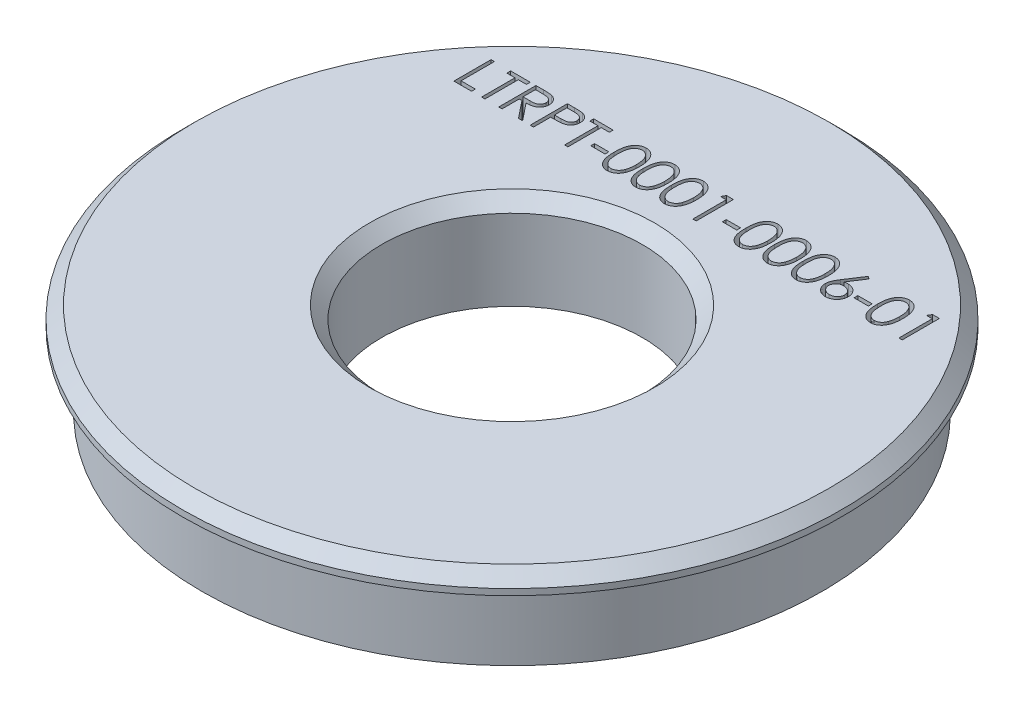
from build123d import *
from build123d.topology import SkipClean

# Parameters (mm, degrees)
SKETCH1_R           = 25
BOSS_EXTRUDE1_DEPTH = 6
CUT_EXTRUDE1_REACH  = 37.861
SKETCH2_R           = 10.5
SKETCH3_R           = 2.5
CUT_EXTRUDE2_DEPTH  = 36.860842154
SKETCH5_R           = 1.25
CUT_EXTRUDE3_DEPTH  = 4
BOSS_EXTRUDE2_START = 1.5
SKETCH6_R           = 26.576681464
SKETCH6_R_2         = 10.5
SKETCH6_R_3         = 1.25
BOSS_EXTRUDE2_DEPTH = 1.5
SKETCH7_R           = 4.5
CUT_EXTRUDE4_DEPTH  = 5
SKETCH8_R           = 2.5
BOSS_EXTRUDE3_DEPTH = 3
SKETCH9_R           = 25
SKETCH9_R_2         = 10.5
SKETCH9_R_3         = 2.5
BOSS_EXTRUDE4_DEPTH = 5
BOSS_EXTRUDE5_START = -4.5
SKETCH10_R          = 2.5
BOSS_EXTRUDE5_DEPTH = 4.5
CHAMFER1_SIZE       = 1
CUT_EXTRUDE5_START  = -2
SKETCH11_R          = 2.5
CUT_EXTRUDE5_DEPTH  = 2
SKETCH12_W          = 1.153846154
SKETCH12_H          = 0.307692307
CUT_EXTRUDE6_DEPTH  = 2


with BuildPart() as part:
    # Sketch1 → Boss-Extrude1 (new body)
    with BuildSketch(Plane(origin=(0, 0, 0), x_dir=(1, 0, 0), z_dir=(0, 1, 0))):
        with Locations(Location((0, 0, 0), (0, 0, 270))):
            Circle(SKETCH1_R)
    extrude(amount=BOSS_EXTRUDE1_DEPTH)

    # Sketch2 → Cut-Extrude1 (cut, up to next)
    with BuildSketch(Plane(origin=(0, 6, 0), x_dir=(1, 0, 0), z_dir=(0, 1, 0)), mode=Mode.PRIVATE) as cut_extrude1_sk1:
        with Locations(Location((0, 0, 0), (0, 0, 270))):
            Circle(SKETCH2_R)
    cut_extrude1_tool1 = extrude(cut_extrude1_sk1.sketch, amount=-CUT_EXTRUDE1_REACH, mode=Mode.PRIVATE) & part.part
    add(cut_extrude1_tool1.solids().sort_by_distance((0, 6, 0))[0], mode=Mode.SUBTRACT)

    # Sketch3 → Cut-Extrude2 (cut, through all)
    with BuildSketch(Plane(origin=(0, 6, 0), x_dir=(1, 0, 0), z_dir=(0, 1, 0))):
        with Locations(Location((0, 19, 0), (0, 0, 270))):
            Circle(SKETCH3_R)
        with Locations(Location((16.454482672, 9.5, 0), (0, 0, 270))):
            Circle(SKETCH3_R)
        with Locations(Location((16.454482672, -9.5, 0), (0, 0, 270))):
            Circle(SKETCH3_R)
        with Locations(Location((0, -19, 0), (0, 0, 270))):
            Circle(SKETCH3_R)
        with Locations(Location((-16.454482672, -9.5, 0), (0, 0, 270))):
            Circle(SKETCH3_R)
        with Locations(Location((-16.454482672, 9.5, 0), (0, 0, 270))):
            Circle(SKETCH3_R)
    extrude(amount=-CUT_EXTRUDE2_DEPTH, mode=Mode.SUBTRACT)

    # Sketch5 → Cut-Extrude3 (cut)
    with BuildSketch(Plane(origin=(0, 6, 0), x_dir=(1, 0, 0), z_dir=(0, 1, 0))):
        with Locations(Location((20, 0, 0), (0, 0, 270))):
            Circle(SKETCH5_R)
        with Locations(Location((10, -17.320508076, 0), (0, 0, 270))):
            Circle(SKETCH5_R)
        with Locations(Location((-10, -17.320508076, 0), (0, 0, 270))):
            Circle(SKETCH5_R)
        with Locations(Location((-20, 0, 0), (0, 0, 270))):
            Circle(SKETCH5_R)
        with Locations(Location((-10, 17.320508076, 0), (0, 0, 270))):
            Circle(SKETCH5_R)
        with Locations(Location((10, 17.320508076, 0), (0, 0, 270))):
            Circle(SKETCH5_R)
    extrude(amount=-CUT_EXTRUDE3_DEPTH, mode=Mode.SUBTRACT)

    # Sketch6 → Boss-Extrude2 (add)
    with BuildSketch(Plane(origin=(0, 6, 0), x_dir=(1, 0, 0), z_dir=(0, 1, 0)).offset(BOSS_EXTRUDE2_START)):
        with Locations(Location((0, 0, 0), (0, 0, 270))):
            Circle(SKETCH6_R)
        with Locations(Location((0, 0, 0), (0, 0, 270))):
            Circle(SKETCH6_R_2, mode=Mode.SUBTRACT)
        with Locations(Location((10, -17.320508076, 0), (0, 0, 270))):
            Circle(SKETCH6_R_3, mode=Mode.SUBTRACT)
        with Locations(Location((-10, -17.320508076, 0), (0, 0, 270))):
            Circle(SKETCH6_R_3, mode=Mode.SUBTRACT)
        with Locations(Location((-20, 0, 0), (0, 0, 270))):
            Circle(SKETCH6_R_3, mode=Mode.SUBTRACT)
        with Locations(Location((-10, 17.320508076, 0), (0, 0, 270))):
            Circle(SKETCH6_R_3, mode=Mode.SUBTRACT)
        with Locations(Location((10, 17.320508076, 0), (0, 0, 270))):
            Circle(SKETCH6_R_3, mode=Mode.SUBTRACT)
        with Locations(Location((20, 0, 0), (0, 0, 270))):
            Circle(SKETCH6_R_3, mode=Mode.SUBTRACT)
    extrude(amount=-BOSS_EXTRUDE2_DEPTH)

    # Sketch7 → Cut-Extrude4 (cut)
    with BuildSketch(Plane(origin=(0, 7.5, 0), x_dir=(1, 0, 0), z_dir=(0, 1, 0))):
        with Locations(Location((16.454482672, -9.5, 0), (0, 0, 270))):
            Circle(SKETCH7_R)
        with Locations(Location((-16.454482672, -9.5, 0), (0, 0, 270))):
            Circle(SKETCH7_R)
        with Locations(Location((0, 19, 0), (0, 0, 270))):
            Circle(SKETCH7_R)
    extrude(amount=-CUT_EXTRUDE4_DEPTH, mode=Mode.SUBTRACT)

    # Sketch8 → Boss-Extrude3 (add)
    with BuildSketch(Plane.XZ.offset(-6)):
        with Locations(Location((0, 19, 0), (0, 0, 90))):
            Circle(SKETCH8_R)
        with Locations(Location((16.454482672, -9.5, 0), (0, 0, 90))):
            Circle(SKETCH8_R)
        with Locations(Location((-16.454482672, -9.5, 0), (0, 0, 90))):
            Circle(SKETCH8_R)
    extrude(amount=BOSS_EXTRUDE3_DEPTH)

    # Sketch9 → Boss-Extrude4 (add)
    with SkipClean():  # the faces are left unmerged after this step: merging them gives an invalid solid
        with BuildSketch(Plane(origin=(0, 7.5, 0), x_dir=(1, 0, 0), z_dir=(0, 1, 0))):
            with Locations(Location((0, 0, 0), (0, 0, 270))):
                Circle(SKETCH9_R)
            with Locations(Location((0, 0, 0), (0, 0, 270))):
                Circle(SKETCH9_R_2, mode=Mode.SUBTRACT)
            with Locations(Location((0, -19, 0), (0, 0, 270))):
                Circle(SKETCH9_R_3, mode=Mode.SUBTRACT)
            with Locations(Location((16.454482672, -9.5, 0), (0, 0, 270))):
                Circle(SKETCH9_R_3, mode=Mode.SUBTRACT)
            with Locations(Location((16.454482672, 9.5, 0), (0, 0, 270))):
                Circle(SKETCH9_R_3, mode=Mode.SUBTRACT)
            with Locations(Location((0, 19, 0), (0, 0, 270))):
                Circle(SKETCH9_R_3, mode=Mode.SUBTRACT)
            with Locations(Location((-16.454482672, 9.5, 0), (0, 0, 270))):
                Circle(SKETCH9_R_3, mode=Mode.SUBTRACT)
            with Locations(Location((-16.454482672, -9.5, 0), (0, 0, 270))):
                Circle(SKETCH9_R_3, mode=Mode.SUBTRACT)
        extrude(amount=-BOSS_EXTRUDE4_DEPTH)

    # Sketch10 → Boss-Extrude5 (add)
    with SkipClean():  # the faces are left unmerged after this step: merging them gives an invalid solid
        with BuildSketch(Plane.XZ.offset(-3).offset(BOSS_EXTRUDE5_START)):
            with Locations(Location((0, -19, 0), (0, 0, 90))):
                Circle(SKETCH10_R)
            with Locations(Location((16.454482672, 9.5, 0), (0, 0, 90))):
                Circle(SKETCH10_R)
            with Locations(Location((-16.454482672, 9.5, 0), (0, 0, 90))):
                Circle(SKETCH10_R)
        extrude(amount=BOSS_EXTRUDE5_DEPTH)

    # Chamfer1
    chamfer1_edges = [part.edges().sort_by_distance(p)[0] for p in [
        (0, 7.5, -26.576681464),
        (0, 7.5, -10.5),
    ]]
    chamfer(chamfer1_edges, length=CHAMFER1_SIZE)

    # Sketch11 → Cut-Extrude5 (cut)
    with SkipClean():  # the faces are left unmerged after this step: merging them gives an invalid solid
        with BuildSketch(Plane.XZ.offset(-3).offset(CUT_EXTRUDE5_START)):
            with Locations(Location((-16.454482672, -9.5, 0), (0, 0, 90))):
                Circle(SKETCH11_R)
            with Locations(Location((-16.454482672, 9.5, 0), (0, 0, 90))):
                Circle(SKETCH11_R)
            with Locations(Location((0, 19, 0), (0, 0, 90))):
                Circle(SKETCH11_R)
            with Locations(Location((16.454482672, 9.5, 0), (0, 0, 90))):
                Circle(SKETCH11_R)
            with Locations(Location((16.454482672, -9.5, 0), (0, 0, 90))):
                Circle(SKETCH11_R)
            with Locations(Location((0, -19, 0), (0, 0, 90))):
                Circle(SKETCH11_R)
        extrude(amount=CUT_EXTRUDE5_DEPTH, mode=Mode.SUBTRACT)

    # Sketch12 → Cut-Extrude6 (cut)
    # profile 1 of 18: a face of its own
    with SkipClean():  # the faces are left unmerged after this step: merging them gives an invalid solid
        with BuildSketch(Plane(origin=(0, 7.5, 0), x_dir=(1, 0, 0), z_dir=(0, 1, 0))):
            Polygon((-17.993353455, 16.308227892), (-17.724122686, 16.308227892), (-17.724122686, 13.615920199), (-16.570276532, 13.615920199), (-16.570276532, 13.308227892), (-17.993353455, 13.308227892), align=None)
        # profile 2 of 18: a face of its own
        with BuildSketch(Plane(origin=(0, 7.5, 0), x_dir=(1, 0, 0), z_dir=(0, 1, 0))):
            Polygon((-16.416430379, 16.000535584), (-16.416430379, 16.308227892), (-14.839507302, 16.308227892), (-14.839507302, 16.000535584), (-15.493353455, 16.000535584), (-15.493353455, 13.308227892), (-15.762584225, 13.308227892), (-15.762584225, 16.000535584), align=None)
        # profile 3 of 18: a face of its own
        with BuildSketch(Plane(origin=(0, 7.5, 0), x_dir=(1, 0, 0), z_dir=(0, 1, 0))):
            with BuildLine():
                Line((-14.37796884, 16.308227892), (-13.777608263, 16.308227892))
                add(Edge.make_bspline(
                    [(-13.777608263, 16.308227892), (-13.737544439, 16.308094532), (-13.660617458, 16.307838467), (-13.550411797, 16.306410671), (-13.450274286, 16.302318366), (-13.360257281, 16.298796723), (-13.280362434, 16.292375059), (-13.210344756, 16.286237361), (-13.150526729, 16.278202795), (-13.114316, 16.270741004), (-13.097920763, 16.267362507)],
                    knots=[0, 0, 0, 0, 1.410062039, 2.707475311, 3.878576406, 4.937260626, 5.877586885, 6.699081471, 7.410979367, 8, 8, 8, 8], degree=3))
                add(Edge.make_bspline(
                    [(-13.097920763, 16.267362507), (-13.075972228, 16.261939565), (-13.03254338, 16.251209368), (-12.970014752, 16.22852971), (-12.910431046, 16.202284318), (-12.854039768, 16.171458272), (-12.801123375, 16.135822746), (-12.751136252, 16.095992927), (-12.703851569, 16.052186751), (-12.6611816, 16.003299744), (-12.620948127, 15.952011307), (-12.587015019, 15.896550944), (-12.557763751, 15.838555349), (-12.534474736, 15.777434705), (-12.515722187, 15.713781758), (-12.502499696, 15.647019932), (-12.494570107, 15.577453382), (-12.493762802, 15.530003746), (-12.493353455, 15.505944238)],
                    knots=[0, 0, 0, 0, 1.027469482, 2.033020251, 3.019912614, 3.986113645, 4.951240523, 5.91722682, 6.890402269, 7.87763091, 8.8651537, 9.85103654, 10.82876324, 11.815024772, 12.821070561, 13.842952187, 14.906261191, 16, 16, 16, 16], degree=3))
                add(Edge.make_bspline(
                    [(-12.493353455, 15.505944238), (-12.494612597, 15.465971291), (-12.497069507, 15.387973719), (-12.519976739, 15.274778677), (-12.55749947, 15.169187836), (-12.609205147, 15.071334147), (-12.675050411, 14.983125022), (-12.754185947, 14.905647489), (-12.846655899, 14.840813278), (-12.93273817, 14.795853731), (-13.008778913, 14.76705981), (-13.071378895, 14.746800073), (-13.139664876, 14.73114696), (-13.212982591, 14.71712399), (-13.291637153, 14.706536824), (-13.375440044, 14.6987826), (-13.464451031, 14.693936272), (-13.525598805, 14.693214554), (-13.557055379, 14.692843276)],
                    knots=[0, 0, 0, 0, 1.260483769, 2.459530307, 3.627416485, 4.787058657, 5.939039949, 7.08810263, 8.267026773, 9.491475466, 10.141966685, 10.831826277, 11.566392101, 12.351337768, 13.187381173, 14.07005841, 15.007169909, 16, 16, 16, 16], degree=3))
                Line((-13.557055379, 14.692843276), (-12.454891917, 13.308227892))
                Line((-12.454891917, 13.308227892), (-12.787824609, 13.308227892))
                Line((-12.787824609, 13.308227892), (-13.889988071, 14.692843276))
                Line((-13.889988071, 14.692843276), (-14.108738071, 14.692843276))
                Line((-14.108738071, 14.692843276), (-14.108738071, 13.308227892))
                Line((-14.108738071, 13.308227892), (-14.37796884, 13.308227892))
                Line((-14.37796884, 13.308227892), (-14.37796884, 16.308227892))
            make_face()
            with BuildLine():
                Line((-14.108738071, 16.000535584), (-14.108738071, 15.000535584))
                Line((-14.108738071, 15.000535584), (-13.559459225, 14.996328853))
                add(Edge.make_bspline(
                    [(-13.559459225, 14.996328853), (-13.533813477, 14.996317508), (-13.484104714, 14.996295516), (-13.412189858, 14.999718753), (-13.345229763, 15.003613026), (-13.283480546, 15.009569608), (-13.226914625, 15.017246241), (-13.17556027, 15.026848799), (-13.129333655, 15.038036281), (-13.075420622, 15.05535196), (-13.01521788, 15.08278569), (-12.949790915, 15.122698975), (-12.894074625, 15.172901077), (-12.847002172, 15.230306896), (-12.809176945, 15.293423681), (-12.78250947, 15.361494855), (-12.765587376, 15.432801939), (-12.76359148, 15.481811745), (-12.762584225, 15.506545199)],
                    knots=[0, 0, 0, 0, 1.146690395, 2.22261258, 3.21895312, 4.145990853, 4.996080663, 5.770904154, 6.481378293, 7.121626537, 8.300444488, 9.431385265, 10.535395872, 11.636531494, 12.74115979, 13.810798291, 14.895190096, 16, 16, 16, 16], degree=3))
                add(Edge.make_bspline(
                    [(-12.762584225, 15.506545199), (-12.763614614, 15.530670834), (-12.76565647, 15.578479039), (-12.782326843, 15.648469819), (-12.810517742, 15.714527205), (-12.848508231, 15.776382478), (-12.894793221, 15.832530251), (-12.949065632, 15.880570668), (-13.009841514, 15.920213066), (-13.066645398, 15.945545393), (-13.11741758, 15.961076695), (-13.161500146, 15.972006264), (-13.211309984, 15.980787238), (-13.267088948, 15.987822718), (-13.328598918, 15.993869813), (-13.396150904, 15.997942767), (-13.469296716, 16.00035465), (-13.519994085, 16.000473869), (-13.546238071, 16.000535584)],
                    knots=[0, 0, 0, 0, 1.101028733, 2.181837193, 3.264309656, 4.369019818, 5.486613113, 6.575447106, 7.666700264, 8.788928104, 9.402425223, 10.0903467, 10.862060571, 11.710948788, 12.657782767, 13.684531032, 14.801375019, 16, 16, 16, 16], degree=3))
                Line((-13.546238071, 16.000535584), (-14.108738071, 16.000535584))
            make_face(mode=Mode.SUBTRACT)
        # profile 4 of 18: a face of its own
        with BuildSketch(Plane(origin=(0, 7.5, 0), x_dir=(1, 0, 0), z_dir=(0, 1, 0))):
            with BuildLine():
                Line((-11.839507302, 16.308227892), (-11.251165955, 16.308227892))
                add(Edge.make_bspline(
                    [(-11.251165955, 16.308227892), (-11.210699464, 16.308183409), (-11.133163871, 16.308098179), (-11.021979537, 16.305514111), (-10.920999767, 16.302062661), (-10.830442298, 16.297278181), (-10.750028499, 16.291623961), (-10.680122243, 16.283693641), (-10.620174052, 16.275413388), (-10.584254238, 16.266995039), (-10.567872686, 16.263155776)],
                    knots=[0, 0, 0, 0, 1.415646017, 2.712440637, 3.8905458, 4.950247383, 5.884950622, 6.709939814, 7.411656543, 8, 8, 8, 8], degree=3))
                add(Edge.make_bspline(
                    [(-10.567872686, 16.263155776), (-10.547135372, 16.257479819), (-10.506149391, 16.246261652), (-10.447091354, 16.223792746), (-10.390902344, 16.197150891), (-10.337389579, 16.166787513), (-10.287210651, 16.131399887), (-10.239616902, 16.0924225), (-10.195028347, 16.048955442), (-10.153695725, 16.001486236), (-10.115737328, 15.95081177), (-10.083054742, 15.896175573), (-10.055688548, 15.838497313), (-10.032217172, 15.777817109), (-10.015324211, 15.713625404), (-10.002598297, 15.646368222), (-9.994520902, 15.576052773), (-9.993747278, 15.528001458), (-9.993353455, 15.503540392)],
                    knots=[0, 0, 0, 0, 0.999701418, 1.975846123, 2.934577507, 3.890451536, 4.834027766, 5.787354733, 6.749476667, 7.726910423, 8.712836071, 9.690891519, 10.682875813, 11.679750201, 12.712814741, 13.765529915, 14.8625177, 16, 16, 16, 16], degree=3))
                add(Edge.make_bspline(
                    [(-9.993353455, 15.503540392), (-9.993714677, 15.478873726), (-9.99442143, 15.430611728), (-10.002903961, 15.360006481), (-10.014329839, 15.292533575), (-10.031898741, 15.228342618), (-10.054909318, 15.167814815), (-10.081902506, 15.110025187), (-10.114459818, 15.055956897), (-10.151869672, 15.005413653), (-10.193485324, 14.958348014), (-10.2391307, 14.915101048), (-10.288621522, 14.8759259), (-10.341800506, 14.840734749), (-10.399186091, 14.810343652), (-10.459907937, 14.783123105), (-10.524493837, 14.760262196), (-10.56918742, 14.748236429), (-10.591911148, 14.742122123)],
                    knots=[0, 0, 0, 0, 1.121902311, 2.195077645, 3.232258892, 4.234102512, 5.217864754, 6.176164875, 7.132989551, 8.084763148, 9.034132444, 9.988522005, 10.94243251, 11.903244335, 12.886203696, 13.894208494, 14.929344452, 16, 16, 16, 16], degree=3))
                add(Edge.make_bspline(
                    [(-10.591911148, 14.742122123), (-10.610706005, 14.738125282), (-10.651896029, 14.729365972), (-10.719732648, 14.719587295), (-10.798714407, 14.71124078), (-10.888733504, 14.704982662), (-10.989709137, 14.699625204), (-11.101695929, 14.695366837), (-11.22491371, 14.693026963), (-11.31086049, 14.692906283), (-11.355733263, 14.692843276)],
                    knots=[0, 0, 0, 0, 0.601384939, 1.31797006, 2.144135048, 3.087295005, 4.142315834, 5.309527816, 6.595305764, 8, 8, 8, 8], degree=3))
                Line((-11.355733263, 14.692843276), (-11.570276532, 14.692843276))
                Line((-11.570276532, 14.692843276), (-11.570276532, 13.308227892))
                Line((-11.570276532, 13.308227892), (-11.839507302, 13.308227892))
                Line((-11.839507302, 13.308227892), (-11.839507302, 16.308227892))
            make_face()
            with BuildLine():
                Line((-11.570276532, 16.000535584), (-11.570276532, 15.000535584))
                Line((-11.570276532, 15.000535584), (-11.045036148, 14.993925007))
                add(Edge.make_bspline(
                    [(-11.045036148, 14.993925007), (-11.019390497, 14.993911753), (-10.969882097, 14.993886165), (-10.898365334, 14.997302071), (-10.832014517, 15.001245385), (-10.771033452, 15.007019033), (-10.715394651, 15.015180111), (-10.665005341, 15.023418744), (-10.620256241, 15.035337626), (-10.567885497, 15.051385971), (-10.509528342, 15.078756784), (-10.446041871, 15.118485261), (-10.392238512, 15.169125869), (-10.345679972, 15.22606401), (-10.308732076, 15.289406121), (-10.281684083, 15.357179495), (-10.265791662, 15.42868908), (-10.263660639, 15.477621771), (-10.262584225, 15.502338469)],
                    knots=[0, 0, 0, 0, 1.160613943, 2.240541288, 3.23993089, 4.169200891, 5.011653406, 5.7853311, 6.478053781, 7.106038997, 8.262395093, 9.384106736, 10.481365981, 11.59014053, 12.70357646, 13.786202915, 14.881775077, 16, 16, 16, 16], degree=3))
                add(Edge.make_bspline(
                    [(-10.262584225, 15.502338469), (-10.263666493, 15.526457195), (-10.265817909, 15.574402236), (-10.281808649, 15.644669745), (-10.308679489, 15.711728921), (-10.345927999, 15.77427728), (-10.391134682, 15.83101054), (-10.443676976, 15.880293792), (-10.5034312, 15.919912394), (-10.559015398, 15.945483778), (-10.608387843, 15.961096872), (-10.65127238, 15.972021021), (-10.699692958, 15.980742969), (-10.75366534, 15.9878054), (-10.812771198, 15.993851224), (-10.877518325, 15.99795349), (-10.947661448, 16.000354738), (-10.996356223, 16.000473843), (-11.021598648, 16.000535584)],
                    knots=[0, 0, 0, 0, 1.120700087, 2.227813068, 3.331159281, 4.466773991, 5.599788987, 6.693661531, 7.80175334, 8.91857717, 9.525282508, 10.207424825, 10.974604443, 11.810962634, 12.737642355, 13.736264703, 14.826523623, 16, 16, 16, 16], degree=3))
                Line((-11.021598648, 16.000535584), (-11.570276532, 16.000535584))
            make_face(mode=Mode.SUBTRACT)
        # profile 5 of 18: a face of its own
        with BuildSketch(Plane(origin=(0, 7.5, 0), x_dir=(1, 0, 0), z_dir=(0, 1, 0))):
            Polygon((-9.724122686, 16.000535584), (-9.724122686, 16.308227892), (-8.147199609, 16.308227892), (-8.147199609, 16.000535584), (-8.801045763, 16.000535584), (-8.801045763, 13.308227892), (-9.070276532, 13.308227892), (-9.070276532, 16.000535584), align=None)
        # profile 6 of 18: a face of its own
        with BuildSketch(Plane(origin=(0, 7.5, 0), x_dir=(1, 0, 0), z_dir=(0, 1, 0))):
            with Locations((-7.37796884, 14.462074046)):
                Rectangle(SKETCH12_W, SKETCH12_H)
        # profile 7 of 18: a face of its own
        with BuildSketch(Plane(origin=(0, 7.5, 0), x_dir=(1, 0, 0), z_dir=(0, 1, 0))):
            with BuildLine():
                add(Edge.make_bspline(
                    [(-6.570276532, 14.807025969), (-6.569995374, 14.855109444), (-6.56944922, 14.948512288), (-6.56337343, 15.084613409), (-6.55328028, 15.212293657), (-6.539448246, 15.331559142), (-6.522615691, 15.442440655), (-6.500145274, 15.544641875), (-6.474591443, 15.638635824), (-6.444975061, 15.724729008), (-6.411556956, 15.804081325), (-6.375184733, 15.878160069), (-6.334414909, 15.946853154), (-6.291577555, 16.011256974), (-6.244938637, 16.070317284), (-6.195825388, 16.124868137), (-6.142320922, 16.173648781), (-6.086244058, 16.218088468), (-6.027087089, 16.257045158), (-5.966536232, 16.291358934), (-5.904174713, 16.320673106), (-5.83983227, 16.343722051), (-5.774087221, 16.36275992), (-5.706709735, 16.375779018), (-5.637588566, 16.383970654), (-5.59093305, 16.384753798), (-5.567271725, 16.385150969)],
                    knots=[0, 0, 0, 0, 1.646270934, 3.197905019, 4.663502075, 6.030701355, 7.308322542, 8.50163776, 9.611534131, 10.641858119, 11.616356847, 12.558055219, 13.465016945, 14.349605745, 15.204443733, 16.039544428, 16.859896111, 17.680448484, 18.487036065, 19.28249412, 20.06191084, 20.843045899, 21.620316918, 22.403196591, 23.190181807, 24, 24, 24, 24], degree=3))
                add(Edge.make_bspline(
                    [(-5.567271725, 16.385150969), (-5.543412743, 16.384732841), (-5.495964736, 16.383901318), (-5.425815842, 16.375909367), (-5.357287544, 16.362648404), (-5.290671996, 16.343858998), (-5.225422008, 16.320548418), (-5.162047944, 16.291330889), (-5.10015616, 16.257320431), (-5.040730199, 16.217357108), (-4.983117672, 16.172800871), (-4.928733704, 16.122432869), (-4.877573344, 16.066761681), (-4.828994511, 16.006382941), (-4.784375428, 15.940138582), (-4.741883914, 15.869180774), (-4.703850741, 15.792268604), (-4.667221019, 15.710685346), (-4.635603602, 15.622173638), (-4.607089677, 15.527232415), (-4.584050562, 15.424740255), (-4.564859757, 15.315234902), (-4.549992703, 15.198314202), (-4.539164724, 15.074228788), (-4.533444937, 14.942897025), (-4.532367764, 14.853104583), (-4.531814994, 14.807025969)],
                    knots=[0, 0, 0, 0, 0.810914788, 1.612654377, 2.396697861, 3.181598691, 3.963628158, 4.749916497, 5.551656086, 6.361998678, 7.18212741, 8.025565596, 8.878627764, 9.750805457, 10.657531673, 11.591944965, 12.560506719, 13.57287815, 14.630710178, 15.753379473, 16.941251878, 18.199788006, 19.531962791, 20.947069417, 22.433333509, 24, 24, 24, 24], degree=3))
                add(Edge.make_bspline(
                    [(-4.531814994, 14.807025969), (-4.532373495, 14.761148333), (-4.533461711, 14.671757632), (-4.539100603, 14.541016796), (-4.550208001, 14.417589901), (-4.564102277, 14.301180934), (-4.583345959, 14.192274403), (-4.60700753, 14.090493447), (-4.633279236, 13.995398529), (-4.665709059, 13.90776869), (-4.701203954, 13.826381499), (-4.739822693, 13.750381086), (-4.78119683, 13.679095693), (-4.826272897, 13.61309591), (-4.87431868, 13.551914204), (-4.926362499, 13.496630527), (-4.980937286, 13.445912808), (-5.038719357, 13.400782842), (-5.099072115, 13.361281581), (-5.160751324, 13.325955423), (-5.224851367, 13.297470256), (-5.289919612, 13.273011649), (-5.356886783, 13.254325548), (-5.425669403, 13.2414051), (-5.495917606, 13.232343516), (-5.543404661, 13.231652247), (-5.567271725, 13.231304815)],
                    knots=[0, 0, 0, 0, 1.561518951, 3.042555995, 4.452378317, 5.7783523, 7.031515105, 8.214008947, 9.334062868, 10.386615937, 11.391082383, 12.354592575, 13.286541444, 14.194233754, 15.072674879, 15.931287219, 16.775624067, 17.606195743, 18.42308326, 19.229000347, 20.022332153, 20.807536673, 21.593273796, 22.3848459, 23.188221202, 24, 24, 24, 24], degree=3))
                add(Edge.make_bspline(
                    [(-5.567271725, 13.231304815), (-5.590932394, 13.231704548), (-5.637586615, 13.232492744), (-5.706717265, 13.240647371), (-5.773816503, 13.253757802), (-5.839215435, 13.272114892), (-5.90324959, 13.294584751), (-5.965046408, 13.323859337), (-6.025292994, 13.357574253), (-6.083828613, 13.395970329), (-6.139553323, 13.439960343), (-6.192780699, 13.488615448), (-6.242173572, 13.5431498), (-6.288145654, 13.602702306), (-6.33183773, 13.666725085), (-6.372028621, 13.736092262), (-6.409203639, 13.810528785), (-6.443183774, 13.890515566), (-6.4733112, 13.97721979), (-6.499923521, 14.071633371), (-6.520935656, 14.174589631), (-6.538921046, 14.28526166), (-6.55342766, 14.404125028), (-6.563331367, 14.531244267), (-6.569452495, 14.66654016), (-6.569996841, 14.759342824), (-6.570276532, 14.807025969)],
                    knots=[0, 0, 0, 0, 0.810891512, 1.598919785, 2.382837074, 3.152667961, 3.926044502, 4.706494248, 5.493654104, 6.291793342, 7.103789334, 7.925228297, 8.761435821, 9.622817696, 10.50288917, 11.416980706, 12.369136599, 13.353924996, 14.394355917, 15.514179734, 16.714354668, 17.994756427, 19.357759367, 20.818452758, 22.365282078, 24, 24, 24, 24], degree=3))
            make_face()
            with BuildLine():
                add(Edge.make_bspline(
                    [(-6.301045763, 14.808227892), (-6.30094338, 14.768157579), (-6.300744674, 14.690388969), (-6.295553645, 14.577380459), (-6.288482018, 14.47197732), (-6.279360906, 14.374045718), (-6.265815521, 14.283917135), (-6.250638275, 14.200971693), (-6.232168484, 14.125648347), (-6.210315611, 14.057430223), (-6.185424957, 13.995159593), (-6.158248502, 13.937215694), (-6.129053597, 13.882914035), (-6.096380039, 13.83274237), (-6.060795699, 13.786537087), (-6.023104334, 13.743480373), (-5.981899262, 13.705082961), (-5.924896054, 13.659031371), (-5.849641933, 13.611443542), (-5.7548244, 13.570004036), (-5.657394299, 13.543961931), (-5.591264656, 13.54065014), (-5.558257302, 13.538997123)],
                    knots=[0, 0, 0, 0, 1.459021318, 2.831673884, 4.118529203, 5.306027144, 6.411944654, 7.436330062, 8.375795394, 9.233974572, 10.042671642, 10.816086306, 11.563610507, 12.285937304, 12.993564865, 13.685989202, 14.367179055, 15.041617293, 16.353048772, 17.594441528, 18.799311195, 20, 20, 20, 20], degree=3))
                add(Edge.make_bspline(
                    [(-5.558257302, 13.538997123), (-5.52503644, 13.540366649), (-5.458663306, 13.543102874), (-5.361691482, 13.569501792), (-5.26755125, 13.609332826), (-5.193775301, 13.656430688), (-5.137647407, 13.701283541), (-5.097432844, 13.739524669), (-5.060522517, 13.782343983), (-5.025515024, 13.82854338), (-4.993407245, 13.879005509), (-4.96421027, 13.933487717), (-4.9375674, 13.992141298), (-4.922388218, 14.033086788), (-4.914627494, 14.054021161)],
                    knots=[0, 0, 0, 0, 1.353760809, 2.704726607, 4.075137775, 5.516104923, 6.260822281, 7.007110065, 7.778089737, 8.566572457, 9.372053459, 10.217411131, 11.088608312, 12, 12, 12, 12], degree=3))
                add(Edge.make_bspline(
                    [(-4.914627494, 14.054021161), (-4.905583122, 14.080789509), (-4.887219167, 14.135140736), (-4.863551932, 14.219452437), (-4.844913018, 14.307911949), (-4.828144419, 14.399990621), (-4.816698942, 14.496367507), (-4.807486531, 14.596744408), (-4.802060228, 14.701197004), (-4.801387584, 14.772164139), (-4.801045763, 14.808227892)],
                    knots=[0, 0, 0, 0, 0.884706709, 1.796334032, 2.740027952, 3.714592787, 4.726048262, 5.777819803, 6.87074269, 8, 8, 8, 8], degree=3))
                add(Edge.make_bspline(
                    [(-4.801045763, 14.808227892), (-4.801517354, 14.844285811), (-4.802439886, 14.914822809), (-4.805966161, 15.018124107), (-4.815072082, 15.116239331), (-4.825185613, 15.209591165), (-4.840097517, 15.297662853), (-4.856175637, 15.381191686), (-4.877776676, 15.45914285), (-4.900850769, 15.532736777), (-4.927259679, 15.601137338), (-4.956330309, 15.664663441), (-4.98737753, 15.723621776), (-5.021099451, 15.777850583), (-5.057095751, 15.827592763), (-5.096316507, 15.871850987), (-5.137205969, 15.911996959), (-5.194477843, 15.957822019), (-5.269455806, 16.004546329), (-5.362752075, 16.047545552), (-5.459841199, 16.072238374), (-5.525475588, 16.07571982), (-5.558257302, 16.077458661)],
                    knots=[0, 0, 0, 0, 1.31362396, 2.569729283, 3.763502607, 4.902122613, 5.988968491, 7.01645872, 7.998833611, 8.933434873, 9.825090667, 10.667526885, 11.477055099, 12.250526234, 12.991942729, 13.710640831, 14.402115721, 15.076753259, 16.378508321, 17.609869233, 18.806226677, 20, 20, 20, 20], degree=3))
                add(Edge.make_bspline(
                    [(-5.558257302, 16.077458661), (-5.591437809, 16.075717421), (-5.657859271, 16.072231769), (-5.755957518, 16.047637552), (-5.849989819, 16.004769295), (-5.924769512, 15.957667262), (-5.982081329, 15.912805852), (-6.022437923, 15.873903177), (-6.060277499, 15.831349244), (-6.095135528, 15.784719032), (-6.127783485, 15.73460586), (-6.15776721, 15.68061549), (-6.184782064, 15.622474321), (-6.209711667, 15.560231662), (-6.231631199, 15.492019424), (-6.249711739, 15.416788858), (-6.266414928, 15.334107236), (-6.278239444, 15.243490515), (-6.288751234, 15.145534384), (-6.295506676, 15.039868111), (-6.300762039, 14.926670071), (-6.300949294, 14.848499363), (-6.301045763, 14.808227892)],
                    knots=[0, 0, 0, 0, 1.207732386, 2.417664972, 3.655092373, 4.956220595, 5.625982001, 6.301752483, 6.994047911, 7.697131622, 8.419323945, 9.170223765, 9.943494443, 10.752040957, 11.610060368, 12.549350801, 13.567764191, 14.679664412, 15.874934091, 17.154273443, 18.533957287, 20, 20, 20, 20], degree=3))
            make_face(mode=Mode.SUBTRACT)
        # profile 8 of 18: a face of its own
        with BuildSketch(Plane(origin=(0, 7.5, 0), x_dir=(1, 0, 0), z_dir=(0, 1, 0))):
            with BuildLine():
                add(Edge.make_bspline(
                    [(-4.262584225, 14.807025969), (-4.262303066, 14.855109444), (-4.261756912, 14.948512288), (-4.255681123, 15.084613409), (-4.245587972, 15.212293657), (-4.231755938, 15.331559142), (-4.214923384, 15.442440655), (-4.192452967, 15.544641875), (-4.166899136, 15.638635824), (-4.137282754, 15.724729008), (-4.103864649, 15.804081325), (-4.067492425, 15.878160069), (-4.026722602, 15.946853154), (-3.983885248, 16.011256974), (-3.937246329, 16.070317284), (-3.88813308, 16.124868137), (-3.834628615, 16.173648781), (-3.77855175, 16.218088468), (-3.719394781, 16.257045158), (-3.658843924, 16.291358934), (-3.596482405, 16.320673106), (-3.532139963, 16.343722051), (-3.466394913, 16.36275992), (-3.399017427, 16.375779018), (-3.329896258, 16.383970654), (-3.283240743, 16.384753798), (-3.259579417, 16.385150969)],
                    knots=[0, 0, 0, 0, 1.646270934, 3.197905019, 4.663502075, 6.030701355, 7.308322542, 8.50163776, 9.611534131, 10.641858119, 11.616356847, 12.558055219, 13.465016945, 14.349605745, 15.204443733, 16.039544428, 16.859896111, 17.680448484, 18.487036065, 19.28249412, 20.06191084, 20.843045899, 21.620316918, 22.403196591, 23.190181807, 24, 24, 24, 24], degree=3))
                add(Edge.make_bspline(
                    [(-3.259579417, 16.385150969), (-3.235720435, 16.384732841), (-3.188272428, 16.383901318), (-3.118123535, 16.375909367), (-3.049595236, 16.362648404), (-2.982979689, 16.343858998), (-2.9177297, 16.320548418), (-2.854355637, 16.291330889), (-2.792463852, 16.257320431), (-2.733037892, 16.217357108), (-2.675425364, 16.172800871), (-2.621041396, 16.122432869), (-2.569881037, 16.066761681), (-2.521302203, 16.006382941), (-2.47668312, 15.940138582), (-2.434191607, 15.869180774), (-2.396158433, 15.792268604), (-2.359528711, 15.710685346), (-2.327911294, 15.622173638), (-2.29939737, 15.527232415), (-2.276358254, 15.424740255), (-2.257167449, 15.315234902), (-2.242300395, 15.198314202), (-2.231472416, 15.074228788), (-2.225752629, 14.942897025), (-2.224675457, 14.853104583), (-2.224122686, 14.807025969)],
                    knots=[0, 0, 0, 0, 0.810914788, 1.612654377, 2.396697861, 3.181598691, 3.963628158, 4.749916497, 5.551656086, 6.361998678, 7.18212741, 8.025565596, 8.878627764, 9.750805457, 10.657531673, 11.591944965, 12.560506719, 13.57287815, 14.630710178, 15.753379473, 16.941251878, 18.199788006, 19.531962791, 20.947069417, 22.433333509, 24, 24, 24, 24], degree=3))
                add(Edge.make_bspline(
                    [(-2.224122686, 14.807025969), (-2.224681187, 14.761148333), (-2.225769404, 14.671757632), (-2.231408295, 14.541016796), (-2.242515693, 14.417589901), (-2.256409969, 14.301180934), (-2.275653652, 14.192274403), (-2.299315223, 14.090493447), (-2.325586928, 13.995398529), (-2.358016752, 13.90776869), (-2.393511646, 13.826381499), (-2.432130386, 13.750381086), (-2.473504522, 13.679095693), (-2.518580589, 13.61309591), (-2.566626372, 13.551914204), (-2.618670191, 13.496630527), (-2.673244978, 13.445912808), (-2.731027049, 13.400782842), (-2.791379807, 13.361281581), (-2.853059016, 13.325955423), (-2.917159059, 13.297470256), (-2.982227304, 13.273011649), (-3.049194475, 13.254325548), (-3.117977096, 13.2414051), (-3.188225298, 13.232343516), (-3.235712354, 13.231652247), (-3.259579417, 13.231304815)],
                    knots=[0, 0, 0, 0, 1.561518951, 3.042555995, 4.452378317, 5.7783523, 7.031515105, 8.214008947, 9.334062868, 10.386615937, 11.391082383, 12.354592575, 13.286541444, 14.194233754, 15.072674879, 15.931287219, 16.775624067, 17.606195743, 18.42308326, 19.229000347, 20.022332153, 20.807536673, 21.593273796, 22.3848459, 23.188221202, 24, 24, 24, 24], degree=3))
                add(Edge.make_bspline(
                    [(-3.259579417, 13.231304815), (-3.283240086, 13.231704548), (-3.329894307, 13.232492744), (-3.399024958, 13.240647371), (-3.466124195, 13.253757802), (-3.531523127, 13.272114892), (-3.595557283, 13.294584751), (-3.6573541, 13.323859337), (-3.717600686, 13.357574253), (-3.776136305, 13.395970329), (-3.831861015, 13.439960343), (-3.885088391, 13.488615448), (-3.934481264, 13.5431498), (-3.980453346, 13.602702306), (-4.024145422, 13.666725085), (-4.064336313, 13.736092262), (-4.101511331, 13.810528785), (-4.135491466, 13.890515566), (-4.165618892, 13.97721979), (-4.192231213, 14.071633371), (-4.213243348, 14.174589631), (-4.231228738, 14.28526166), (-4.245735352, 14.404125028), (-4.25563906, 14.531244267), (-4.261760187, 14.66654016), (-4.262304533, 14.759342824), (-4.262584225, 14.807025969)],
                    knots=[0, 0, 0, 0, 0.810891512, 1.598919785, 2.382837074, 3.152667961, 3.926044502, 4.706494248, 5.493654104, 6.291793342, 7.103789334, 7.925228297, 8.761435821, 9.622817696, 10.50288917, 11.416980706, 12.369136599, 13.353924996, 14.394355917, 15.514179734, 16.714354668, 17.994756427, 19.357759367, 20.818452758, 22.365282078, 24, 24, 24, 24], degree=3))
            make_face()
            with BuildLine():
                add(Edge.make_bspline(
                    [(-3.993353455, 14.808227892), (-3.993251072, 14.768157579), (-3.993052367, 14.690388969), (-3.987861337, 14.577380459), (-3.98078971, 14.47197732), (-3.971668598, 14.374045718), (-3.958123214, 14.283917135), (-3.942945967, 14.200971693), (-3.924476176, 14.125648347), (-3.902623303, 14.057430223), (-3.877732649, 13.995159593), (-3.850556194, 13.937215694), (-3.821361289, 13.882914035), (-3.788687731, 13.83274237), (-3.753103392, 13.786537087), (-3.715412027, 13.743480373), (-3.674206954, 13.705082961), (-3.617203746, 13.659031371), (-3.541949626, 13.611443542), (-3.447132092, 13.570004036), (-3.349701992, 13.543961931), (-3.283572349, 13.54065014), (-3.250564994, 13.538997123)],
                    knots=[0, 0, 0, 0, 1.459021318, 2.831673884, 4.118529203, 5.306027144, 6.411944654, 7.436330062, 8.375795394, 9.233974572, 10.042671642, 10.816086306, 11.563610507, 12.285937304, 12.993564865, 13.685989202, 14.367179055, 15.041617293, 16.353048772, 17.594441528, 18.799311195, 20, 20, 20, 20], degree=3))
                add(Edge.make_bspline(
                    [(-3.250564994, 13.538997123), (-3.217344132, 13.540366649), (-3.150970998, 13.543102874), (-3.053999174, 13.569501792), (-2.959858942, 13.609332826), (-2.886082994, 13.656430688), (-2.829955099, 13.701283541), (-2.789740536, 13.739524669), (-2.752830209, 13.782343983), (-2.717822716, 13.82854338), (-2.685714937, 13.879005509), (-2.656517962, 13.933487717), (-2.629875093, 13.992141298), (-2.61469591, 14.033086788), (-2.606935186, 14.054021161)],
                    knots=[0, 0, 0, 0, 1.353760809, 2.704726607, 4.075137775, 5.516104923, 6.260822281, 7.007110065, 7.778089737, 8.566572457, 9.372053459, 10.217411131, 11.088608312, 12, 12, 12, 12], degree=3))
                add(Edge.make_bspline(
                    [(-2.606935186, 14.054021161), (-2.597890814, 14.080789509), (-2.579526859, 14.135140736), (-2.555859624, 14.219452437), (-2.53722071, 14.307911949), (-2.520452111, 14.399990621), (-2.509006635, 14.496367507), (-2.499794223, 14.596744408), (-2.49436792, 14.701197004), (-2.493695276, 14.772164139), (-2.493353455, 14.808227892)],
                    knots=[0, 0, 0, 0, 0.884706709, 1.796334032, 2.740027952, 3.714592787, 4.726048262, 5.777819803, 6.87074269, 8, 8, 8, 8], degree=3))
                add(Edge.make_bspline(
                    [(-2.493353455, 14.808227892), (-2.493825046, 14.844285811), (-2.494747579, 14.914822809), (-2.498273854, 15.018124107), (-2.507379775, 15.116239331), (-2.517493305, 15.209591165), (-2.532405209, 15.297662853), (-2.548483329, 15.381191686), (-2.570084368, 15.45914285), (-2.593158461, 15.532736777), (-2.619567372, 15.601137338), (-2.648638001, 15.664663441), (-2.679685223, 15.723621776), (-2.713407143, 15.777850583), (-2.749403443, 15.827592763), (-2.788624199, 15.871850987), (-2.829513662, 15.911996959), (-2.886785535, 15.957822019), (-2.961763498, 16.004546329), (-3.055059767, 16.047545552), (-3.152148891, 16.072238374), (-3.21778328, 16.07571982), (-3.250564994, 16.077458661)],
                    knots=[0, 0, 0, 0, 1.31362396, 2.569729283, 3.763502607, 4.902122613, 5.988968491, 7.01645872, 7.998833611, 8.933434873, 9.825090667, 10.667526885, 11.477055099, 12.250526234, 12.991942729, 13.710640831, 14.402115721, 15.076753259, 16.378508321, 17.609869233, 18.806226677, 20, 20, 20, 20], degree=3))
                add(Edge.make_bspline(
                    [(-3.250564994, 16.077458661), (-3.283745501, 16.075717421), (-3.350166963, 16.072231769), (-3.44826521, 16.047637552), (-3.542297512, 16.004769295), (-3.617077204, 15.957667262), (-3.674389021, 15.912805852), (-3.714745616, 15.873903177), (-3.752585192, 15.831349244), (-3.78744322, 15.784719032), (-3.820091177, 15.73460586), (-3.850074903, 15.68061549), (-3.877089757, 15.622474321), (-3.902019359, 15.560231662), (-3.923938892, 15.492019424), (-3.942019432, 15.416788858), (-3.95872262, 15.334107236), (-3.970547136, 15.243490515), (-3.981058927, 15.145534384), (-3.987814368, 15.039868111), (-3.993069731, 14.926670071), (-3.993256987, 14.848499363), (-3.993353455, 14.808227892)],
                    knots=[0, 0, 0, 0, 1.207732386, 2.417664972, 3.655092373, 4.956220595, 5.625982001, 6.301752483, 6.994047911, 7.697131622, 8.419323945, 9.170223765, 9.943494443, 10.752040957, 11.610060368, 12.549350801, 13.567764191, 14.679664412, 15.874934091, 17.154273443, 18.533957287, 20, 20, 20, 20], degree=3))
            make_face(mode=Mode.SUBTRACT)
        # profile 9 of 18: a face of its own
        with BuildSketch(Plane(origin=(0, 7.5, 0), x_dir=(1, 0, 0), z_dir=(0, 1, 0))):
            with BuildLine():
                add(Edge.make_bspline(
                    [(-1.954891917, 14.807025969), (-1.954610759, 14.855109444), (-1.954064604, 14.948512288), (-1.947988815, 15.084613409), (-1.937895664, 15.212293657), (-1.92406363, 15.331559142), (-1.907231076, 15.442440655), (-1.884760659, 15.544641875), (-1.859206828, 15.638635824), (-1.829590446, 15.724729008), (-1.796172341, 15.804081325), (-1.759800118, 15.878160069), (-1.719030294, 15.946853154), (-1.67619294, 16.011256974), (-1.629554021, 16.070317284), (-1.580440772, 16.124868137), (-1.526936307, 16.173648781), (-1.470859443, 16.218088468), (-1.411702473, 16.257045158), (-1.351151617, 16.291358934), (-1.288790097, 16.320673106), (-1.224447655, 16.343722051), (-1.158702605, 16.36275992), (-1.091325119, 16.375779018), (-1.02220395, 16.383970654), (-0.975548435, 16.384753798), (-0.951887109, 16.385150969)],
                    knots=[0, 0, 0, 0, 1.646270934, 3.197905019, 4.663502075, 6.030701355, 7.308322542, 8.50163776, 9.611534131, 10.641858119, 11.616356847, 12.558055219, 13.465016945, 14.349605745, 15.204443733, 16.039544428, 16.859896111, 17.680448484, 18.487036065, 19.28249412, 20.06191084, 20.843045899, 21.620316918, 22.403196591, 23.190181807, 24, 24, 24, 24], degree=3))
                add(Edge.make_bspline(
                    [(-0.951887109, 16.385150969), (-0.928028128, 16.384732841), (-0.88058012, 16.383901318), (-0.810431227, 16.375909367), (-0.741902928, 16.362648404), (-0.675287381, 16.343858998), (-0.610037393, 16.320548418), (-0.546663329, 16.291330889), (-0.484771545, 16.257320431), (-0.425345584, 16.217357108), (-0.367733056, 16.172800871), (-0.313349088, 16.122432869), (-0.262188729, 16.066761681), (-0.213609896, 16.006382941), (-0.168990812, 15.940138582), (-0.126499299, 15.869180774), (-0.088466125, 15.792268604), (-0.051836404, 15.710685346), (-0.020218987, 15.622173638), (0.008294938, 15.527232415), (0.031334054, 15.424740255), (0.050524859, 15.315234902), (0.065391912, 15.198314202), (0.076219891, 15.074228788), (0.081939678, 14.942897025), (0.083016851, 14.853104583), (0.083569621, 14.807025969)],
                    knots=[0, 0, 0, 0, 0.810914788, 1.612654377, 2.396697861, 3.181598691, 3.963628158, 4.749916497, 5.551656086, 6.361998678, 7.18212741, 8.025565596, 8.878627764, 9.750805457, 10.657531673, 11.591944965, 12.560506719, 13.57287815, 14.630710178, 15.753379473, 16.941251878, 18.199788006, 19.531962791, 20.947069417, 22.433333509, 24, 24, 24, 24], degree=3))
                add(Edge.make_bspline(
                    [(0.083569621, 14.807025969), (0.08301112, 14.761148333), (0.081922904, 14.671757632), (0.076284012, 14.541016796), (0.065176614, 14.417589901), (0.051282339, 14.301180934), (0.032038656, 14.192274403), (0.008377085, 14.090493447), (-0.01789462, 13.995398529), (-0.050324444, 13.90776869), (-0.085819338, 13.826381499), (-0.124438078, 13.750381086), (-0.165812215, 13.679095693), (-0.210888282, 13.61309591), (-0.258934065, 13.551914204), (-0.310977884, 13.496630527), (-0.365552671, 13.445912808), (-0.423334741, 13.400782842), (-0.4836875, 13.361281581), (-0.545366708, 13.325955423), (-0.609466751, 13.297470256), (-0.674534997, 13.273011649), (-0.741502167, 13.254325548), (-0.810284788, 13.2414051), (-0.88053299, 13.232343516), (-0.928020046, 13.231652247), (-0.951887109, 13.231304815)],
                    knots=[0, 0, 0, 0, 1.561518951, 3.042555995, 4.452378317, 5.7783523, 7.031515105, 8.214008947, 9.334062868, 10.386615937, 11.391082383, 12.354592575, 13.286541444, 14.194233754, 15.072674879, 15.931287219, 16.775624067, 17.606195743, 18.42308326, 19.229000347, 20.022332153, 20.807536673, 21.593273796, 22.3848459, 23.188221202, 24, 24, 24, 24], degree=3))
                add(Edge.make_bspline(
                    [(-0.951887109, 13.231304815), (-0.975547778, 13.231704548), (-1.022202, 13.232492744), (-1.09133265, 13.240647371), (-1.158431887, 13.253757802), (-1.223830819, 13.272114892), (-1.287864975, 13.294584751), (-1.349661792, 13.323859337), (-1.409908378, 13.357574253), (-1.468443998, 13.395970329), (-1.524168707, 13.439960343), (-1.577396083, 13.488615448), (-1.626788957, 13.5431498), (-1.672761039, 13.602702306), (-1.716453114, 13.666725085), (-1.756644006, 13.736092262), (-1.793819023, 13.810528785), (-1.827799158, 13.890515566), (-1.857926584, 13.97721979), (-1.884538905, 14.071633371), (-1.90555104, 14.174589631), (-1.923536431, 14.28526166), (-1.938043045, 14.404125028), (-1.947946752, 14.531244267), (-1.954067879, 14.66654016), (-1.954612225, 14.759342824), (-1.954891917, 14.807025969)],
                    knots=[0, 0, 0, 0, 0.810891512, 1.598919785, 2.382837074, 3.152667961, 3.926044502, 4.706494248, 5.493654104, 6.291793342, 7.103789334, 7.925228297, 8.761435821, 9.622817696, 10.50288917, 11.416980706, 12.369136599, 13.353924996, 14.394355917, 15.514179734, 16.714354668, 17.994756427, 19.357759367, 20.818452758, 22.365282078, 24, 24, 24, 24], degree=3))
            make_face()
            with BuildLine():
                add(Edge.make_bspline(
                    [(-1.685661148, 14.808227892), (-1.685558765, 14.768157579), (-1.685360059, 14.690388969), (-1.68016903, 14.577380459), (-1.673097402, 14.47197732), (-1.663976291, 14.374045718), (-1.650430906, 14.283917135), (-1.635253659, 14.200971693), (-1.616783868, 14.125648347), (-1.594930996, 14.057430223), (-1.570040341, 13.995159593), (-1.542863887, 13.937215694), (-1.513668981, 13.882914035), (-1.480995424, 13.83274237), (-1.445411084, 13.786537087), (-1.407719719, 13.743480373), (-1.366514647, 13.705082961), (-1.309511439, 13.659031371), (-1.234257318, 13.611443542), (-1.139439785, 13.570004036), (-1.042009684, 13.543961931), (-0.975880041, 13.54065014), (-0.942872686, 13.538997123)],
                    knots=[0, 0, 0, 0, 1.459021318, 2.831673884, 4.118529203, 5.306027144, 6.411944654, 7.436330062, 8.375795394, 9.233974572, 10.042671642, 10.816086306, 11.563610507, 12.285937304, 12.993564865, 13.685989202, 14.367179055, 15.041617293, 16.353048772, 17.594441528, 18.799311195, 20, 20, 20, 20], degree=3))
                add(Edge.make_bspline(
                    [(-0.942872686, 13.538997123), (-0.909651825, 13.540366649), (-0.843278691, 13.543102874), (-0.746306866, 13.569501792), (-0.652166635, 13.609332826), (-0.578390686, 13.656430688), (-0.522262791, 13.701283541), (-0.482048229, 13.739524669), (-0.445137901, 13.782343983), (-0.410130409, 13.82854338), (-0.378022629, 13.879005509), (-0.348825654, 13.933487717), (-0.322182785, 13.992141298), (-0.307003603, 14.033086788), (-0.299242879, 14.054021161)],
                    knots=[0, 0, 0, 0, 1.353760809, 2.704726607, 4.075137775, 5.516104923, 6.260822281, 7.007110065, 7.778089737, 8.566572457, 9.372053459, 10.217411131, 11.088608312, 12, 12, 12, 12], degree=3))
                add(Edge.make_bspline(
                    [(-0.299242879, 14.054021161), (-0.290198506, 14.080789509), (-0.271834551, 14.135140736), (-0.248167316, 14.219452437), (-0.229528403, 14.307911949), (-0.212759804, 14.399990621), (-0.201314327, 14.496367507), (-0.192101916, 14.596744408), (-0.186675613, 14.701197004), (-0.186002969, 14.772164139), (-0.185661148, 14.808227892)],
                    knots=[0, 0, 0, 0, 0.884706709, 1.796334032, 2.740027952, 3.714592787, 4.726048262, 5.777819803, 6.87074269, 8, 8, 8, 8], degree=3))
                add(Edge.make_bspline(
                    [(-0.185661148, 14.808227892), (-0.186132739, 14.844285811), (-0.187055271, 14.914822809), (-0.190581546, 15.018124107), (-0.199687467, 15.116239331), (-0.209800998, 15.209591165), (-0.224712901, 15.297662853), (-0.240791021, 15.381191686), (-0.262392061, 15.45914285), (-0.285466153, 15.532736777), (-0.311875064, 15.601137338), (-0.340945693, 15.664663441), (-0.371992915, 15.723621776), (-0.405714835, 15.777850583), (-0.441711135, 15.827592763), (-0.480931892, 15.871850987), (-0.521821354, 15.911996959), (-0.579093228, 15.957822019), (-0.65407119, 16.004546329), (-0.747367459, 16.047545552), (-0.844456583, 16.072238374), (-0.910090972, 16.07571982), (-0.942872686, 16.077458661)],
                    knots=[0, 0, 0, 0, 1.31362396, 2.569729283, 3.763502607, 4.902122613, 5.988968491, 7.01645872, 7.998833611, 8.933434873, 9.825090667, 10.667526885, 11.477055099, 12.250526234, 12.991942729, 13.710640831, 14.402115721, 15.076753259, 16.378508321, 17.609869233, 18.806226677, 20, 20, 20, 20], degree=3))
                add(Edge.make_bspline(
                    [(-0.942872686, 16.077458661), (-0.976053194, 16.075717421), (-1.042474656, 16.072231769), (-1.140572903, 16.047637552), (-1.234605204, 16.004769295), (-1.309384897, 15.957667262), (-1.366696714, 15.912805852), (-1.407053308, 15.873903177), (-1.444892884, 15.831349244), (-1.479750913, 15.784719032), (-1.51239887, 15.73460586), (-1.542382595, 15.68061549), (-1.569397449, 15.622474321), (-1.594327051, 15.560231662), (-1.616246584, 15.492019424), (-1.634327124, 15.416788858), (-1.651030312, 15.334107236), (-1.662854828, 15.243490515), (-1.673366619, 15.145534384), (-1.68012206, 15.039868111), (-1.685377424, 14.926670071), (-1.685564679, 14.848499363), (-1.685661148, 14.808227892)],
                    knots=[0, 0, 0, 0, 1.207732386, 2.417664972, 3.655092373, 4.956220595, 5.625982001, 6.301752483, 6.994047911, 7.697131622, 8.419323945, 9.170223765, 9.943494443, 10.752040957, 11.610060368, 12.549350801, 13.567764191, 14.679664412, 15.874934091, 17.154273443, 18.533957287, 20, 20, 20, 20], degree=3))
            make_face(mode=Mode.SUBTRACT)
        # profile 10 of 18: a face of its own
        with BuildSketch(Plane(origin=(0, 7.5, 0), x_dir=(1, 0, 0), z_dir=(0, 1, 0))):
            Polygon((0.990420583, 16.308227892), (1.545108083, 16.308227892), (1.545108083, 13.308227892), (1.275877314, 13.308227892), (1.275877314, 16.000535584), (0.814338852, 16.000535584), align=None)
        # profile 11 of 18: a face of its own
        with BuildSketch(Plane(origin=(0, 7.5, 0), x_dir=(1, 0, 0), z_dir=(0, 1, 0))):
            with Locations((3.237415775, 14.462074046)):
                Rectangle(SKETCH12_W, SKETCH12_H)
        # profile 12 of 18: a face of its own
        with BuildSketch(Plane(origin=(0, 7.5, 0), x_dir=(1, 0, 0), z_dir=(0, 1, 0))):
            with BuildLine():
                add(Edge.make_bspline(
                    [(4.045108083, 14.807025969), (4.045389241, 14.855109444), (4.045935396, 14.948512288), (4.052011185, 15.084613409), (4.062104336, 15.212293657), (4.07593637, 15.331559142), (4.092768924, 15.442440655), (4.115239341, 15.544641875), (4.140793172, 15.638635824), (4.170409554, 15.724729008), (4.203827659, 15.804081325), (4.240199882, 15.878160069), (4.280969706, 15.946853154), (4.32380706, 16.011256974), (4.370445979, 16.070317284), (4.419559228, 16.124868137), (4.473063693, 16.173648781), (4.529140557, 16.218088468), (4.588297527, 16.257045158), (4.648848383, 16.291358934), (4.711209903, 16.320673106), (4.775552345, 16.343722051), (4.841297395, 16.36275992), (4.908674881, 16.375779018), (4.97779605, 16.383970654), (5.024451565, 16.384753798), (5.048112891, 16.385150969)],
                    knots=[0, 0, 0, 0, 1.646270934, 3.197905019, 4.663502075, 6.030701355, 7.308322542, 8.50163776, 9.611534131, 10.641858119, 11.616356847, 12.558055219, 13.465016945, 14.349605745, 15.204443733, 16.039544428, 16.859896111, 17.680448484, 18.487036065, 19.28249412, 20.06191084, 20.843045899, 21.620316918, 22.403196591, 23.190181807, 24, 24, 24, 24], degree=3))
                add(Edge.make_bspline(
                    [(5.048112891, 16.385150969), (5.071971872, 16.384732841), (5.11941988, 16.383901318), (5.189568773, 16.375909367), (5.258097072, 16.362648404), (5.324712619, 16.343858998), (5.389962607, 16.320548418), (5.453336671, 16.291330889), (5.515228455, 16.257320431), (5.574654416, 16.217357108), (5.632266944, 16.172800871), (5.686650912, 16.122432869), (5.737811271, 16.066761681), (5.786390104, 16.006382941), (5.831009188, 15.940138582), (5.873500701, 15.869180774), (5.911533875, 15.792268604), (5.948163596, 15.710685346), (5.979781013, 15.622173638), (6.008294938, 15.527232415), (6.031334054, 15.424740255), (6.050524859, 15.315234902), (6.065391912, 15.198314202), (6.076219891, 15.074228788), (6.081939678, 14.942897025), (6.083016851, 14.853104583), (6.083569621, 14.807025969)],
                    knots=[0, 0, 0, 0, 0.810914788, 1.612654377, 2.396697861, 3.181598691, 3.963628158, 4.749916497, 5.551656086, 6.361998678, 7.18212741, 8.025565596, 8.878627764, 9.750805457, 10.657531673, 11.591944965, 12.560506719, 13.57287815, 14.630710178, 15.753379473, 16.941251878, 18.199788006, 19.531962791, 20.947069417, 22.433333509, 24, 24, 24, 24], degree=3))
                add(Edge.make_bspline(
                    [(6.083569621, 14.807025969), (6.08301112, 14.761148333), (6.081922904, 14.671757632), (6.076284012, 14.541016796), (6.065176614, 14.417589901), (6.051282339, 14.301180934), (6.032038656, 14.192274403), (6.008377085, 14.090493447), (5.98210538, 13.995398529), (5.949675556, 13.90776869), (5.914180662, 13.826381499), (5.875561922, 13.750381086), (5.834187785, 13.679095693), (5.789111718, 13.61309591), (5.741065935, 13.551914204), (5.689022116, 13.496630527), (5.634447329, 13.445912808), (5.576665259, 13.400782842), (5.5163125, 13.361281581), (5.454633292, 13.325955423), (5.390533249, 13.297470256), (5.325465003, 13.273011649), (5.258497833, 13.254325548), (5.189715212, 13.2414051), (5.11946701, 13.232343516), (5.071979954, 13.231652247), (5.048112891, 13.231304815)],
                    knots=[0, 0, 0, 0, 1.561518951, 3.042555995, 4.452378317, 5.7783523, 7.031515105, 8.214008947, 9.334062868, 10.386615937, 11.391082383, 12.354592575, 13.286541444, 14.194233754, 15.072674879, 15.931287219, 16.775624067, 17.606195743, 18.42308326, 19.229000347, 20.022332153, 20.807536673, 21.593273796, 22.3848459, 23.188221202, 24, 24, 24, 24], degree=3))
                add(Edge.make_bspline(
                    [(5.048112891, 13.231304815), (5.024452222, 13.231704548), (4.977798, 13.232492744), (4.90866735, 13.240647371), (4.841568113, 13.253757802), (4.776169181, 13.272114892), (4.712135025, 13.294584751), (4.650338208, 13.323859337), (4.590091622, 13.357574253), (4.531556002, 13.395970329), (4.475831293, 13.439960343), (4.422603917, 13.488615448), (4.373211043, 13.5431498), (4.327238961, 13.602702306), (4.283546886, 13.666725085), (4.243355994, 13.736092262), (4.206180977, 13.810528785), (4.172200842, 13.890515566), (4.142073416, 13.97721979), (4.115461095, 14.071633371), (4.09444896, 14.174589631), (4.076463569, 14.28526166), (4.061956955, 14.404125028), (4.052053248, 14.531244267), (4.045932121, 14.66654016), (4.045387775, 14.759342824), (4.045108083, 14.807025969)],
                    knots=[0, 0, 0, 0, 0.810891512, 1.598919785, 2.382837074, 3.152667961, 3.926044502, 4.706494248, 5.493654104, 6.291793342, 7.103789334, 7.925228297, 8.761435821, 9.622817696, 10.50288917, 11.416980706, 12.369136599, 13.353924996, 14.394355917, 15.514179734, 16.714354668, 17.994756427, 19.357759367, 20.818452758, 22.365282078, 24, 24, 24, 24], degree=3))
            make_face()
            with BuildLine():
                add(Edge.make_bspline(
                    [(4.314338852, 14.808227892), (4.314441235, 14.768157579), (4.314639941, 14.690388969), (4.31983097, 14.577380459), (4.326902598, 14.47197732), (4.336023709, 14.374045718), (4.349569094, 14.283917135), (4.364746341, 14.200971693), (4.383216132, 14.125648347), (4.405069004, 14.057430223), (4.429959659, 13.995159593), (4.457136113, 13.937215694), (4.486331019, 13.882914035), (4.519004576, 13.83274237), (4.554588916, 13.786537087), (4.592280281, 13.743480373), (4.633485353, 13.705082961), (4.690488561, 13.659031371), (4.765742682, 13.611443542), (4.860560215, 13.570004036), (4.957990316, 13.543961931), (5.024119959, 13.54065014), (5.057127314, 13.538997123)],
                    knots=[0, 0, 0, 0, 1.459021318, 2.831673884, 4.118529203, 5.306027144, 6.411944654, 7.436330062, 8.375795394, 9.233974572, 10.042671642, 10.816086306, 11.563610507, 12.285937304, 12.993564865, 13.685989202, 14.367179055, 15.041617293, 16.353048772, 17.594441528, 18.799311195, 20, 20, 20, 20], degree=3))
                add(Edge.make_bspline(
                    [(5.057127314, 13.538997123), (5.090348175, 13.540366649), (5.156721309, 13.543102874), (5.253693134, 13.569501792), (5.347833365, 13.609332826), (5.421609314, 13.656430688), (5.477737209, 13.701283541), (5.517951771, 13.739524669), (5.554862099, 13.782343983), (5.589869591, 13.82854338), (5.621977371, 13.879005509), (5.651174346, 13.933487717), (5.677817215, 13.992141298), (5.692996397, 14.033086788), (5.700757121, 14.054021161)],
                    knots=[0, 0, 0, 0, 1.353760809, 2.704726607, 4.075137775, 5.516104923, 6.260822281, 7.007110065, 7.778089737, 8.566572457, 9.372053459, 10.217411131, 11.088608312, 12, 12, 12, 12], degree=3))
                add(Edge.make_bspline(
                    [(5.700757121, 14.054021161), (5.709801494, 14.080789509), (5.728165449, 14.135140736), (5.751832684, 14.219452437), (5.770471597, 14.307911949), (5.787240196, 14.399990621), (5.798685673, 14.496367507), (5.807898084, 14.596744408), (5.813324387, 14.701197004), (5.813997031, 14.772164139), (5.814338852, 14.808227892)],
                    knots=[0, 0, 0, 0, 0.884706709, 1.796334032, 2.740027952, 3.714592787, 4.726048262, 5.777819803, 6.87074269, 8, 8, 8, 8], degree=3))
                add(Edge.make_bspline(
                    [(5.814338852, 14.808227892), (5.813867261, 14.844285811), (5.812944729, 14.914822809), (5.809418454, 15.018124107), (5.800312533, 15.116239331), (5.790199002, 15.209591165), (5.775287099, 15.297662853), (5.759208979, 15.381191686), (5.737607939, 15.45914285), (5.714533847, 15.532736777), (5.688124936, 15.601137338), (5.659054307, 15.664663441), (5.628007085, 15.723621776), (5.594285165, 15.777850583), (5.558288865, 15.827592763), (5.519068108, 15.871850987), (5.478178646, 15.911996959), (5.420906772, 15.957822019), (5.34592881, 16.004546329), (5.252632541, 16.047545552), (5.155543417, 16.072238374), (5.089909028, 16.07571982), (5.057127314, 16.077458661)],
                    knots=[0, 0, 0, 0, 1.31362396, 2.569729283, 3.763502607, 4.902122613, 5.988968491, 7.01645872, 7.998833611, 8.933434873, 9.825090667, 10.667526885, 11.477055099, 12.250526234, 12.991942729, 13.710640831, 14.402115721, 15.076753259, 16.378508321, 17.609869233, 18.806226677, 20, 20, 20, 20], degree=3))
                add(Edge.make_bspline(
                    [(5.057127314, 16.077458661), (5.023946806, 16.075717421), (4.957525344, 16.072231769), (4.859427097, 16.047637552), (4.765394796, 16.004769295), (4.690615103, 15.957667262), (4.633303286, 15.912805852), (4.592946692, 15.873903177), (4.555107116, 15.831349244), (4.520249087, 15.784719032), (4.48760113, 15.73460586), (4.457617405, 15.68061549), (4.430602551, 15.622474321), (4.405672949, 15.560231662), (4.383753416, 15.492019424), (4.365672876, 15.416788858), (4.348969688, 15.334107236), (4.337145172, 15.243490515), (4.326633381, 15.145534384), (4.31987794, 15.039868111), (4.314622576, 14.926670071), (4.314435321, 14.848499363), (4.314338852, 14.808227892)],
                    knots=[0, 0, 0, 0, 1.207732386, 2.417664972, 3.655092373, 4.956220595, 5.625982001, 6.301752483, 6.994047911, 7.697131622, 8.419323945, 9.170223765, 9.943494443, 10.752040957, 11.610060368, 12.549350801, 13.567764191, 14.679664412, 15.874934091, 17.154273443, 18.533957287, 20, 20, 20, 20], degree=3))
            make_face(mode=Mode.SUBTRACT)
        # profile 13 of 18: a face of its own
        with BuildSketch(Plane(origin=(0, 7.5, 0), x_dir=(1, 0, 0), z_dir=(0, 1, 0))):
            with BuildLine():
                add(Edge.make_bspline(
                    [(6.352800391, 14.807025969), (6.353081549, 14.855109444), (6.353627703, 14.948512288), (6.359703493, 15.084613409), (6.369796643, 15.212293657), (6.383628677, 15.331559142), (6.400461232, 15.442440655), (6.422931649, 15.544641875), (6.44848548, 15.638635824), (6.478101862, 15.724729008), (6.511519967, 15.804081325), (6.54789219, 15.878160069), (6.588662014, 15.946853154), (6.631499368, 16.011256974), (6.678138286, 16.070317284), (6.727251535, 16.124868137), (6.780756001, 16.173648781), (6.836832865, 16.218088468), (6.895989834, 16.257045158), (6.956540691, 16.291358934), (7.01890221, 16.320673106), (7.083244653, 16.343722051), (7.148989702, 16.36275992), (7.216367188, 16.375779018), (7.285488357, 16.383970654), (7.332143873, 16.384753798), (7.355805198, 16.385150969)],
                    knots=[0, 0, 0, 0, 1.646270934, 3.197905019, 4.663502075, 6.030701355, 7.308322542, 8.50163776, 9.611534131, 10.641858119, 11.616356847, 12.558055219, 13.465016945, 14.349605745, 15.204443733, 16.039544428, 16.859896111, 17.680448484, 18.487036065, 19.28249412, 20.06191084, 20.843045899, 21.620316918, 22.403196591, 23.190181807, 24, 24, 24, 24], degree=3))
                add(Edge.make_bspline(
                    [(7.355805198, 16.385150969), (7.37966418, 16.384732841), (7.427112188, 16.383901318), (7.497261081, 16.375909367), (7.565789379, 16.362648404), (7.632404927, 16.343858998), (7.697654915, 16.320548418), (7.761028979, 16.291330889), (7.822920763, 16.257320431), (7.882346724, 16.217357108), (7.939959251, 16.172800871), (7.99434322, 16.122432869), (8.045503579, 16.066761681), (8.094082412, 16.006382941), (8.138701495, 15.940138582), (8.181193009, 15.869180774), (8.219226182, 15.792268604), (8.255855904, 15.710685346), (8.287473321, 15.622173638), (8.315987246, 15.527232415), (8.339026362, 15.424740255), (8.358217166, 15.315234902), (8.37308422, 15.198314202), (8.383912199, 15.074228788), (8.389631986, 14.942897025), (8.390709159, 14.853104583), (8.391261929, 14.807025969)],
                    knots=[0, 0, 0, 0, 0.810914788, 1.612654377, 2.396697861, 3.181598691, 3.963628158, 4.749916497, 5.551656086, 6.361998678, 7.18212741, 8.025565596, 8.878627764, 9.750805457, 10.657531673, 11.591944965, 12.560506719, 13.57287815, 14.630710178, 15.753379473, 16.941251878, 18.199788006, 19.531962791, 20.947069417, 22.433333509, 24, 24, 24, 24], degree=3))
                add(Edge.make_bspline(
                    [(8.391261929, 14.807025969), (8.390703428, 14.761148333), (8.389615212, 14.671757632), (8.38397632, 14.541016796), (8.372868922, 14.417589901), (8.358974646, 14.301180934), (8.339730964, 14.192274403), (8.316069393, 14.090493447), (8.289797687, 13.995398529), (8.257367864, 13.90776869), (8.221872969, 13.826381499), (8.18325423, 13.750381086), (8.141880093, 13.679095693), (8.096804026, 13.61309591), (8.048758243, 13.551914204), (7.996714424, 13.496630527), (7.942139637, 13.445912808), (7.884357566, 13.400782842), (7.824004808, 13.361281581), (7.762325599, 13.325955423), (7.698225556, 13.297470256), (7.633157311, 13.273011649), (7.56619014, 13.254325548), (7.49740752, 13.2414051), (7.427159317, 13.232343516), (7.379672262, 13.231652247), (7.355805198, 13.231304815)],
                    knots=[0, 0, 0, 0, 1.561518951, 3.042555995, 4.452378317, 5.7783523, 7.031515105, 8.214008947, 9.334062868, 10.386615937, 11.391082383, 12.354592575, 13.286541444, 14.194233754, 15.072674879, 15.931287219, 16.775624067, 17.606195743, 18.42308326, 19.229000347, 20.022332153, 20.807536673, 21.593273796, 22.3848459, 23.188221202, 24, 24, 24, 24], degree=3))
                add(Edge.make_bspline(
                    [(7.355805198, 13.231304815), (7.332144529, 13.231704548), (7.285490308, 13.232492744), (7.216359658, 13.240647371), (7.14926042, 13.253757802), (7.083861488, 13.272114892), (7.019827333, 13.294584751), (6.958030515, 13.323859337), (6.897783929, 13.357574253), (6.83924831, 13.395970329), (6.783523601, 13.439960343), (6.730296225, 13.488615448), (6.680903351, 13.5431498), (6.634931269, 13.602702306), (6.591239193, 13.666725085), (6.551048302, 13.736092262), (6.513873284, 13.810528785), (6.479893149, 13.890515566), (6.449765724, 13.97721979), (6.423153402, 14.071633371), (6.402141267, 14.174589631), (6.384155877, 14.28526166), (6.369649263, 14.404125028), (6.359745556, 14.531244267), (6.353624428, 14.66654016), (6.353080082, 14.759342824), (6.352800391, 14.807025969)],
                    knots=[0, 0, 0, 0, 0.810891512, 1.598919785, 2.382837074, 3.152667961, 3.926044502, 4.706494248, 5.493654104, 6.291793342, 7.103789334, 7.925228297, 8.761435821, 9.622817696, 10.50288917, 11.416980706, 12.369136599, 13.353924996, 14.394355917, 15.514179734, 16.714354668, 17.994756427, 19.357759367, 20.818452758, 22.365282078, 24, 24, 24, 24], degree=3))
            make_face()
            with BuildLine():
                add(Edge.make_bspline(
                    [(6.62203116, 14.808227892), (6.622133543, 14.768157579), (6.622332249, 14.690388969), (6.627523278, 14.577380459), (6.634594905, 14.47197732), (6.643716017, 14.374045718), (6.657261402, 14.283917135), (6.672438648, 14.200971693), (6.690908439, 14.125648347), (6.712761312, 14.057430223), (6.737651966, 13.995159593), (6.764828421, 13.937215694), (6.794023326, 13.882914035), (6.826696884, 13.83274237), (6.862281224, 13.786537087), (6.899972589, 13.743480373), (6.941177661, 13.705082961), (6.998180869, 13.659031371), (7.07343499, 13.611443542), (7.168252523, 13.570004036), (7.265682624, 13.543961931), (7.331812267, 13.54065014), (7.364819621, 13.538997123)],
                    knots=[0, 0, 0, 0, 1.459021318, 2.831673884, 4.118529203, 5.306027144, 6.411944654, 7.436330062, 8.375795394, 9.233974572, 10.042671642, 10.816086306, 11.563610507, 12.285937304, 12.993564865, 13.685989202, 14.367179055, 15.041617293, 16.353048772, 17.594441528, 18.799311195, 20, 20, 20, 20], degree=3))
                add(Edge.make_bspline(
                    [(7.364819621, 13.538997123), (7.398040483, 13.540366649), (7.464413617, 13.543102874), (7.561385441, 13.569501792), (7.655525673, 13.609332826), (7.729301622, 13.656430688), (7.785429516, 13.701283541), (7.825644079, 13.739524669), (7.862554406, 13.782343983), (7.897561899, 13.82854338), (7.929669678, 13.879005509), (7.958866653, 13.933487717), (7.985509523, 13.992141298), (8.000688705, 14.033086788), (8.008449429, 14.054021161)],
                    knots=[0, 0, 0, 0, 1.353760809, 2.704726607, 4.075137775, 5.516104923, 6.260822281, 7.007110065, 7.778089737, 8.566572457, 9.372053459, 10.217411131, 11.088608312, 12, 12, 12, 12], degree=3))
                add(Edge.make_bspline(
                    [(8.008449429, 14.054021161), (8.017493802, 14.080789509), (8.035857756, 14.135140736), (8.059524991, 14.219452437), (8.078163905, 14.307911949), (8.094932504, 14.399990621), (8.106377981, 14.496367507), (8.115590392, 14.596744408), (8.121016695, 14.701197004), (8.121689339, 14.772164139), (8.12203116, 14.808227892)],
                    knots=[0, 0, 0, 0, 0.884706709, 1.796334032, 2.740027952, 3.714592787, 4.726048262, 5.777819803, 6.87074269, 8, 8, 8, 8], degree=3))
                add(Edge.make_bspline(
                    [(8.12203116, 14.808227892), (8.121559569, 14.844285811), (8.120637037, 14.914822809), (8.117110762, 15.018124107), (8.108004841, 15.116239331), (8.09789131, 15.209591165), (8.082979406, 15.297662853), (8.066901286, 15.381191686), (8.045300247, 15.45914285), (8.022226154, 15.532736777), (7.995817244, 15.601137338), (7.966746614, 15.664663441), (7.935699393, 15.723621776), (7.901977472, 15.777850583), (7.865981172, 15.827592763), (7.826760416, 15.871850987), (7.785870954, 15.911996959), (7.72859908, 15.957822019), (7.653621117, 16.004546329), (7.560324848, 16.047545552), (7.463235725, 16.072238374), (7.397601335, 16.07571982), (7.364819621, 16.077458661)],
                    knots=[0, 0, 0, 0, 1.31362396, 2.569729283, 3.763502607, 4.902122613, 5.988968491, 7.01645872, 7.998833611, 8.933434873, 9.825090667, 10.667526885, 11.477055099, 12.250526234, 12.991942729, 13.710640831, 14.402115721, 15.076753259, 16.378508321, 17.609869233, 18.806226677, 20, 20, 20, 20], degree=3))
                add(Edge.make_bspline(
                    [(7.364819621, 16.077458661), (7.331639114, 16.075717421), (7.265217652, 16.072231769), (7.167119405, 16.047637552), (7.073087104, 16.004769295), (6.998307411, 15.957667262), (6.940995594, 15.912805852), (6.900639, 15.873903177), (6.862799424, 15.831349244), (6.827941395, 15.784719032), (6.795293438, 15.73460586), (6.765309713, 15.68061549), (6.738294859, 15.622474321), (6.713365256, 15.560231662), (6.691445724, 15.492019424), (6.673365184, 15.416788858), (6.656661995, 15.334107236), (6.644837479, 15.243490515), (6.634325689, 15.145534384), (6.627570248, 15.039868111), (6.622314884, 14.926670071), (6.622127629, 14.848499363), (6.62203116, 14.808227892)],
                    knots=[0, 0, 0, 0, 1.207732386, 2.417664972, 3.655092373, 4.956220595, 5.625982001, 6.301752483, 6.994047911, 7.697131622, 8.419323945, 9.170223765, 9.943494443, 10.752040957, 11.610060368, 12.549350801, 13.567764191, 14.679664412, 15.874934091, 17.154273443, 18.533957287, 20, 20, 20, 20], degree=3))
            make_face(mode=Mode.SUBTRACT)
        # profile 14 of 18: a face of its own
        with BuildSketch(Plane(origin=(0, 7.5, 0), x_dir=(1, 0, 0), z_dir=(0, 1, 0))):
            with BuildLine():
                add(Edge.make_bspline(
                    [(8.660492698, 14.807025969), (8.660773857, 14.855109444), (8.661320011, 14.948512288), (8.6673958, 15.084613409), (8.677488951, 15.212293657), (8.691320985, 15.331559142), (8.708153539, 15.442440655), (8.730623956, 15.544641875), (8.756177787, 15.638635824), (8.785794169, 15.724729008), (8.819212274, 15.804081325), (8.855584498, 15.878160069), (8.896354322, 15.946853154), (8.939191675, 16.011256974), (8.985830594, 16.070317284), (9.034943843, 16.124868137), (9.088448308, 16.173648781), (9.144525173, 16.218088468), (9.203682142, 16.257045158), (9.264232999, 16.291358934), (9.326594518, 16.320673106), (9.390936961, 16.343722051), (9.45668201, 16.36275992), (9.524059496, 16.375779018), (9.593180665, 16.383970654), (9.639836181, 16.384753798), (9.663497506, 16.385150969)],
                    knots=[0, 0, 0, 0, 1.646270934, 3.197905019, 4.663502075, 6.030701355, 7.308322542, 8.50163776, 9.611534131, 10.641858119, 11.616356847, 12.558055219, 13.465016945, 14.349605745, 15.204443733, 16.039544428, 16.859896111, 17.680448484, 18.487036065, 19.28249412, 20.06191084, 20.843045899, 21.620316918, 22.403196591, 23.190181807, 24, 24, 24, 24], degree=3))
                add(Edge.make_bspline(
                    [(9.663497506, 16.385150969), (9.687356488, 16.384732841), (9.734804495, 16.383901318), (9.804953388, 16.375909367), (9.873481687, 16.362648404), (9.940097234, 16.343858998), (10.005347223, 16.320548418), (10.068721287, 16.291330889), (10.130613071, 16.257320431), (10.190039031, 16.217357108), (10.247651559, 16.172800871), (10.302035527, 16.122432869), (10.353195887, 16.066761681), (10.40177472, 16.006382941), (10.446393803, 15.940138582), (10.488885316, 15.869180774), (10.52691849, 15.792268604), (10.563548212, 15.710685346), (10.595165629, 15.622173638), (10.623679553, 15.527232415), (10.646718669, 15.424740255), (10.665909474, 15.315234902), (10.680776528, 15.198314202), (10.691604507, 15.074228788), (10.697324294, 14.942897025), (10.698401466, 14.853104583), (10.698954237, 14.807025969)],
                    knots=[0, 0, 0, 0, 0.810914788, 1.612654377, 2.396697861, 3.181598691, 3.963628158, 4.749916497, 5.551656086, 6.361998678, 7.18212741, 8.025565596, 8.878627764, 9.750805457, 10.657531673, 11.591944965, 12.560506719, 13.57287815, 14.630710178, 15.753379473, 16.941251878, 18.199788006, 19.531962791, 20.947069417, 22.433333509, 24, 24, 24, 24], degree=3))
                add(Edge.make_bspline(
                    [(10.698954237, 14.807025969), (10.698395736, 14.761148333), (10.697307519, 14.671757632), (10.691668628, 14.541016796), (10.68056123, 14.417589901), (10.666666954, 14.301180934), (10.647423271, 14.192274403), (10.6237617, 14.090493447), (10.597489995, 13.995398529), (10.565060172, 13.90776869), (10.529565277, 13.826381499), (10.490946537, 13.750381086), (10.449572401, 13.679095693), (10.404496334, 13.61309591), (10.356450551, 13.551914204), (10.304406732, 13.496630527), (10.249831945, 13.445912808), (10.192049874, 13.400782842), (10.131697116, 13.361281581), (10.070017907, 13.325955423), (10.005917864, 13.297470256), (9.940849619, 13.273011649), (9.873882448, 13.254325548), (9.805099827, 13.2414051), (9.734851625, 13.232343516), (9.687364569, 13.231652247), (9.663497506, 13.231304815)],
                    knots=[0, 0, 0, 0, 1.561518951, 3.042555995, 4.452378317, 5.7783523, 7.031515105, 8.214008947, 9.334062868, 10.386615937, 11.391082383, 12.354592575, 13.286541444, 14.194233754, 15.072674879, 15.931287219, 16.775624067, 17.606195743, 18.42308326, 19.229000347, 20.022332153, 20.807536673, 21.593273796, 22.3848459, 23.188221202, 24, 24, 24, 24], degree=3))
                add(Edge.make_bspline(
                    [(9.663497506, 13.231304815), (9.639836837, 13.231704548), (9.593182616, 13.232492744), (9.524051965, 13.240647371), (9.456952728, 13.253757802), (9.391553796, 13.272114892), (9.32751964, 13.294584751), (9.265722823, 13.323859337), (9.205476237, 13.357574253), (9.146940618, 13.395970329), (9.091215908, 13.439960343), (9.037988532, 13.488615448), (8.988595659, 13.5431498), (8.942623577, 13.602702306), (8.898931501, 13.666725085), (8.85874061, 13.736092262), (8.821565592, 13.810528785), (8.787585457, 13.890515566), (8.757458031, 13.97721979), (8.73084571, 14.071633371), (8.709833575, 14.174589631), (8.691848185, 14.28526166), (8.677341571, 14.404125028), (8.667437863, 14.531244267), (8.661316736, 14.66654016), (8.66077239, 14.759342824), (8.660492698, 14.807025969)],
                    knots=[0, 0, 0, 0, 0.810891512, 1.598919785, 2.382837074, 3.152667961, 3.926044502, 4.706494248, 5.493654104, 6.291793342, 7.103789334, 7.925228297, 8.761435821, 9.622817696, 10.50288917, 11.416980706, 12.369136599, 13.353924996, 14.394355917, 15.514179734, 16.714354668, 17.994756427, 19.357759367, 20.818452758, 22.365282078, 24, 24, 24, 24], degree=3))
            make_face()
            with BuildLine():
                add(Edge.make_bspline(
                    [(8.929723468, 14.808227892), (8.929825851, 14.768157579), (8.930024557, 14.690388969), (8.935215586, 14.577380459), (8.942287213, 14.47197732), (8.951408325, 14.374045718), (8.964953709, 14.283917135), (8.980130956, 14.200971693), (8.998600747, 14.125648347), (9.02045362, 14.057430223), (9.045344274, 13.995159593), (9.072520729, 13.937215694), (9.101715634, 13.882914035), (9.134389192, 13.83274237), (9.169973532, 13.786537087), (9.207664896, 13.743480373), (9.248869969, 13.705082961), (9.305873177, 13.659031371), (9.381127298, 13.611443542), (9.475944831, 13.570004036), (9.573374931, 13.543961931), (9.639504574, 13.54065014), (9.672511929, 13.538997123)],
                    knots=[0, 0, 0, 0, 1.459021318, 2.831673884, 4.118529203, 5.306027144, 6.411944654, 7.436330062, 8.375795394, 9.233974572, 10.042671642, 10.816086306, 11.563610507, 12.285937304, 12.993564865, 13.685989202, 14.367179055, 15.041617293, 16.353048772, 17.594441528, 18.799311195, 20, 20, 20, 20], degree=3))
                add(Edge.make_bspline(
                    [(9.672511929, 13.538997123), (9.705732791, 13.540366649), (9.772105925, 13.543102874), (9.869077749, 13.569501792), (9.963217981, 13.609332826), (10.036993929, 13.656430688), (10.093121824, 13.701283541), (10.133336387, 13.739524669), (10.170246714, 13.782343983), (10.205254207, 13.82854338), (10.237361986, 13.879005509), (10.266558961, 13.933487717), (10.29320183, 13.992141298), (10.308381013, 14.033086788), (10.316141737, 14.054021161)],
                    knots=[0, 0, 0, 0, 1.353760809, 2.704726607, 4.075137775, 5.516104923, 6.260822281, 7.007110065, 7.778089737, 8.566572457, 9.372053459, 10.217411131, 11.088608312, 12, 12, 12, 12], degree=3))
                add(Edge.make_bspline(
                    [(10.316141737, 14.054021161), (10.325186109, 14.080789509), (10.343550064, 14.135140736), (10.367217299, 14.219452437), (10.385856213, 14.307911949), (10.402624812, 14.399990621), (10.414070288, 14.496367507), (10.4232827, 14.596744408), (10.428709003, 14.701197004), (10.429381647, 14.772164139), (10.429723468, 14.808227892)],
                    knots=[0, 0, 0, 0, 0.884706709, 1.796334032, 2.740027952, 3.714592787, 4.726048262, 5.777819803, 6.87074269, 8, 8, 8, 8], degree=3))
                add(Edge.make_bspline(
                    [(10.429723468, 14.808227892), (10.429251877, 14.844285811), (10.428329344, 14.914822809), (10.424803069, 15.018124107), (10.415697148, 15.116239331), (10.405583618, 15.209591165), (10.390671714, 15.297662853), (10.374593594, 15.381191686), (10.352992555, 15.45914285), (10.329918462, 15.532736777), (10.303509551, 15.601137338), (10.274438922, 15.664663441), (10.2433917, 15.723621776), (10.20966978, 15.777850583), (10.17367348, 15.827592763), (10.134452724, 15.871850987), (10.093563261, 15.911996959), (10.036291388, 15.957822019), (9.961313425, 16.004546329), (9.868017156, 16.047545552), (9.770928032, 16.072238374), (9.705293643, 16.07571982), (9.672511929, 16.077458661)],
                    knots=[0, 0, 0, 0, 1.31362396, 2.569729283, 3.763502607, 4.902122613, 5.988968491, 7.01645872, 7.998833611, 8.933434873, 9.825090667, 10.667526885, 11.477055099, 12.250526234, 12.991942729, 13.710640831, 14.402115721, 15.076753259, 16.378508321, 17.609869233, 18.806226677, 20, 20, 20, 20], degree=3))
                add(Edge.make_bspline(
                    [(9.672511929, 16.077458661), (9.639331422, 16.075717421), (9.57290996, 16.072231769), (9.474811713, 16.047637552), (9.380779411, 16.004769295), (9.305999719, 15.957667262), (9.248687902, 15.912805852), (9.208331307, 15.873903177), (9.170491731, 15.831349244), (9.135633703, 15.784719032), (9.102985746, 15.73460586), (9.073002021, 15.68061549), (9.045987167, 15.622474321), (9.021057564, 15.560231662), (8.999138031, 15.492019424), (8.981057492, 15.416788858), (8.964354303, 15.334107236), (8.952529787, 15.243490515), (8.942017996, 15.145534384), (8.935262555, 15.039868111), (8.930007192, 14.926670071), (8.929819937, 14.848499363), (8.929723468, 14.808227892)],
                    knots=[0, 0, 0, 0, 1.207732386, 2.417664972, 3.655092373, 4.956220595, 5.625982001, 6.301752483, 6.994047911, 7.697131622, 8.419323945, 9.170223765, 9.943494443, 10.752040957, 11.610060368, 12.549350801, 13.567764191, 14.679664412, 15.874934091, 17.154273443, 18.533957287, 20, 20, 20, 20], degree=3))
            make_face(mode=Mode.SUBTRACT)
        # profile 15 of 18: a face of its own
        with BuildSketch(Plane(origin=(0, 7.5, 0), x_dir=(1, 0, 0), z_dir=(0, 1, 0))):
            with BuildLine():
                Line((12.352800391, 16.385150969), (12.560132121, 16.222290392))
                Line((12.560132121, 16.222290392), (11.767463852, 15.010150969))
                add(Edge.make_bspline(
                    [(11.767463852, 15.010150969), (11.820238375, 15.018562849), (11.92318105, 15.034971173), (12.027380391, 15.037677984), (12.078160968, 15.038997123)],
                    knots=[0, 0, 0, 0, 1.025318673, 2, 2, 2, 2], degree=3))
                add(Edge.make_bspline(
                    [(12.078160968, 15.038997123), (12.108651679, 15.038177598), (12.168671736, 15.036564389), (12.256791852, 15.02414966), (12.341468083, 15.004585278), (12.422349465, 14.976066202), (12.499726307, 14.939635612), (12.574042646, 14.895973723), (12.643901512, 14.842825997), (12.710202523, 14.783456035), (12.770397178, 14.71769862), (12.82369094, 14.647926046), (12.868456761, 14.574211005), (12.904777265, 14.496590834), (12.932981447, 14.415185183), (12.953542286, 14.330098206), (12.965696222, 14.241271231), (12.967346643, 14.180861366), (12.968185006, 14.150175007)],
                    knots=[0, 0, 0, 0, 1.04369286, 2.054478336, 3.041073146, 4.015093852, 4.984733326, 5.965804835, 6.960378782, 7.985147595, 9.009457201, 10.008161701, 10.986880575, 11.956520048, 12.937015923, 13.931873656, 14.949455224, 16, 16, 16, 16], degree=3))
                add(Edge.make_bspline(
                    [(12.968185006, 14.150175007), (12.966965202, 14.108192404), (12.964564916, 14.025580576), (12.940647376, 13.905257685), (12.903481967, 13.790629814), (12.850358371, 13.683527096), (12.784373471, 13.584096322), (12.703906963, 13.495994494), (12.611812545, 13.417420177), (12.507681003, 13.351714503), (12.395615606, 13.298054745), (12.277885322, 13.259513109), (12.155633482, 13.235784421), (12.072658104, 13.232809619), (12.030685006, 13.231304815)],
                    knots=[0, 0, 0, 0, 1.031375318, 2.029502543, 3.004789286, 3.987476834, 4.960371455, 5.9300674, 6.912260825, 7.929083631, 8.949397511, 9.960523116, 10.96833055, 12, 12, 12, 12], degree=3))
                add(Edge.make_bspline(
                    [(12.030685006, 13.231304815), (11.990316406, 13.232614705), (11.910353276, 13.235209369), (11.792725166, 13.258323031), (11.679699723, 13.295786261), (11.572068825, 13.3473985), (11.472365443, 13.412590971), (11.383166326, 13.491072925), (11.304916233, 13.581166752), (11.23979513, 13.682858478), (11.188144788, 13.792135585), (11.149410566, 13.906081719), (11.126785215, 14.024281703), (11.123623595, 14.104408394), (11.12203116, 14.144766353)],
                    knots=[0, 0, 0, 0, 1.012016664, 2.004627821, 2.994792927, 3.992885782, 4.990978636, 5.973936114, 6.964471063, 7.975201453, 8.993600317, 9.990122807, 10.98767138, 12, 12, 12, 12], degree=3))
                add(Edge.make_bspline(
                    [(11.12203116, 14.144766353), (11.123043827, 14.17566171), (11.1251115, 14.238744126), (11.139548692, 14.334284722), (11.162747087, 14.432042792), (11.188727298, 14.514974958), (11.216177821, 14.582913405), (11.239022855, 14.637687826), (11.267457709, 14.69405446), (11.29777775, 14.753946148), (11.332712209, 14.815819376), (11.370697051, 14.880708235), (11.412782466, 14.947580745), (11.442285463, 14.992961484), (11.457367698, 15.016160584)],
                    knots=[0, 0, 0, 0, 1.173818275, 2.396712641, 3.66331629, 4.989737886, 5.693666774, 6.447286557, 7.243889047, 8.091586357, 8.998013824, 9.943181721, 10.948533338, 12, 12, 12, 12], degree=3))
                Line((11.457367698, 15.016160584), (12.352800391, 16.385150969))
            make_face()
            with BuildLine():
                add(Edge.make_bspline(
                    [(12.021670583, 14.731304815), (11.99881723, 14.73063792), (11.954177994, 14.729335281), (11.888685924, 14.72177078), (11.826703137, 14.707525866), (11.767408451, 14.689383296), (11.71191042, 14.664437816), (11.6598057, 14.634136274), (11.610892798, 14.598460979), (11.56568404, 14.557917341), (11.524695757, 14.513527598), (11.489397645, 14.465982294), (11.458949873, 14.416427262), (11.434194029, 14.364448455), (11.414916821, 14.310065741), (11.400972606, 14.253529241), (11.393212248, 14.194459836), (11.391921192, 14.154403405), (11.391261929, 14.133949046)],
                    knots=[0, 0, 0, 0, 1.129588631, 2.206414736, 3.251139165, 4.268635594, 5.265702196, 6.250456724, 7.242448911, 8.251968645, 9.246821453, 10.222880186, 11.173611482, 12.116736599, 13.062300278, 14.020270554, 14.989073742, 16, 16, 16, 16], degree=3))
                add(Edge.make_bspline(
                    [(11.391261929, 14.133949046), (11.39179881, 14.113677634), (11.392851555, 14.073928415), (11.402410686, 14.015351975), (11.417012185, 13.958982053), (11.438732524, 13.905109254), (11.464641286, 13.85291241), (11.498845849, 13.804282166), (11.536745951, 13.756264963), (11.582049323, 13.712549416), (11.630669348, 13.671872309), (11.682613236, 13.636317806), (11.736750345, 13.605901086), (11.793811564, 13.582063003), (11.852987321, 13.562499328), (11.914770653, 13.548732346), (11.97920453, 13.540949038), (12.022851905, 13.539656301), (12.045108083, 13.538997123)],
                    knots=[0, 0, 0, 0, 0.989467248, 1.94019797, 2.891935182, 3.827694429, 4.772920941, 5.730924762, 6.725747692, 7.756678648, 8.79901574, 9.819492441, 10.826891316, 11.826466727, 12.835195252, 13.867842842, 14.912794438, 16, 16, 16, 16], degree=3))
                add(Edge.make_bspline(
                    [(12.045108083, 13.538997123), (12.067364225, 13.539656352), (12.111011529, 13.540949191), (12.175445923, 13.548731764), (12.237227339, 13.562501463), (12.296410061, 13.582055266), (12.353445573, 13.605929788), (12.407535334, 13.636128576), (12.458987986, 13.672090963), (12.507639928, 13.712479902), (12.552754733, 13.756513775), (12.591563829, 13.803853537), (12.624720886, 13.853305447), (12.651664475, 13.904903638), (12.673145582, 13.959014628), (12.687821125, 14.015343248), (12.697360515, 14.073930699), (12.698415972, 14.113678406), (12.698954237, 14.133949046)],
                    knots=[0, 0, 0, 0, 1.087397944, 2.132534446, 3.165364764, 4.174271784, 5.174024072, 6.181601208, 7.194203697, 8.236725232, 9.267838612, 10.269026844, 11.221737037, 12.171628256, 13.107553087, 14.05945871, 15.010357665, 16, 16, 16, 16], degree=3))
                add(Edge.make_bspline(
                    [(12.698954237, 14.133949046), (12.698482557, 14.154430089), (12.697556803, 14.194627717), (12.68708599, 14.253502818), (12.672563955, 14.310352995), (12.650635643, 14.364820952), (12.622147177, 14.416691746), (12.587447113, 14.466227404), (12.54730491, 14.513807702), (12.500935591, 14.558004395), (12.450458247, 14.598416176), (12.396787745, 14.634090081), (12.340638054, 14.664197204), (12.282066103, 14.689317578), (12.220400775, 14.707445698), (12.156637627, 14.721719907), (12.089961133, 14.729315922), (12.044724041, 14.730633406), (12.021670583, 14.731304815)],
                    knots=[0, 0, 0, 0, 0.978206639, 1.919901502, 2.851605144, 3.780102724, 4.718870031, 5.675451981, 6.667674623, 7.690630536, 8.733308323, 9.756129687, 10.767539656, 11.776269907, 12.797430371, 13.836405707, 14.897401972, 16, 16, 16, 16], degree=3))
            make_face(mode=Mode.SUBTRACT)
        # profile 16 of 18: a face of its own
        with BuildSketch(Plane(origin=(0, 7.5, 0), x_dir=(1, 0, 0), z_dir=(0, 1, 0))):
            with Locations((13.852800391, 14.462074046)):
                Rectangle(SKETCH12_W, SKETCH12_H)
        # profile 17 of 18: a face of its own
        with BuildSketch(Plane(origin=(0, 7.5, 0), x_dir=(1, 0, 0), z_dir=(0, 1, 0))):
            with BuildLine():
                add(Edge.make_bspline(
                    [(14.660492698, 14.807025969), (14.660773857, 14.855109444), (14.661320011, 14.948512288), (14.6673958, 15.084613409), (14.677488951, 15.212293657), (14.691320985, 15.331559142), (14.708153539, 15.442440655), (14.730623956, 15.544641875), (14.756177787, 15.638635824), (14.785794169, 15.724729008), (14.819212274, 15.804081325), (14.855584498, 15.878160069), (14.896354322, 15.946853154), (14.939191675, 16.011256974), (14.985830594, 16.070317284), (15.034943843, 16.124868137), (15.088448308, 16.173648781), (15.144525173, 16.218088468), (15.203682142, 16.257045158), (15.264232999, 16.291358934), (15.326594518, 16.320673106), (15.390936961, 16.343722051), (15.45668201, 16.36275992), (15.524059496, 16.375779018), (15.593180665, 16.383970654), (15.639836181, 16.384753798), (15.663497506, 16.385150969)],
                    knots=[0, 0, 0, 0, 1.646270934, 3.197905019, 4.663502075, 6.030701355, 7.308322542, 8.50163776, 9.611534131, 10.641858119, 11.616356847, 12.558055219, 13.465016945, 14.349605745, 15.204443733, 16.039544428, 16.859896111, 17.680448484, 18.487036065, 19.28249412, 20.06191084, 20.843045899, 21.620316918, 22.403196591, 23.190181807, 24, 24, 24, 24], degree=3))
                add(Edge.make_bspline(
                    [(15.663497506, 16.385150969), (15.687356488, 16.384732841), (15.734804495, 16.383901318), (15.804953388, 16.375909367), (15.873481687, 16.362648404), (15.940097234, 16.343858998), (16.005347223, 16.320548418), (16.068721287, 16.291330889), (16.130613071, 16.257320431), (16.190039031, 16.217357108), (16.247651559, 16.172800871), (16.302035527, 16.122432869), (16.353195887, 16.066761681), (16.40177472, 16.006382941), (16.446393803, 15.940138582), (16.488885316, 15.869180774), (16.52691849, 15.792268604), (16.563548212, 15.710685346), (16.595165629, 15.622173638), (16.623679553, 15.527232415), (16.646718669, 15.424740255), (16.665909474, 15.315234902), (16.680776528, 15.198314202), (16.691604507, 15.074228788), (16.697324294, 14.942897025), (16.698401466, 14.853104583), (16.698954237, 14.807025969)],
                    knots=[0, 0, 0, 0, 0.810914788, 1.612654377, 2.396697861, 3.181598691, 3.963628158, 4.749916497, 5.551656086, 6.361998678, 7.18212741, 8.025565596, 8.878627764, 9.750805457, 10.657531673, 11.591944965, 12.560506719, 13.57287815, 14.630710178, 15.753379473, 16.941251878, 18.199788006, 19.531962791, 20.947069417, 22.433333509, 24, 24, 24, 24], degree=3))
                add(Edge.make_bspline(
                    [(16.698954237, 14.807025969), (16.698395736, 14.761148333), (16.697307519, 14.671757632), (16.691668628, 14.541016796), (16.68056123, 14.417589901), (16.666666954, 14.301180934), (16.647423271, 14.192274403), (16.6237617, 14.090493447), (16.597489995, 13.995398529), (16.565060172, 13.90776869), (16.529565277, 13.826381499), (16.490946537, 13.750381086), (16.449572401, 13.679095693), (16.404496334, 13.61309591), (16.356450551, 13.551914204), (16.304406732, 13.496630527), (16.249831945, 13.445912808), (16.192049874, 13.400782842), (16.131697116, 13.361281581), (16.070017907, 13.325955423), (16.005917864, 13.297470256), (15.940849619, 13.273011649), (15.873882448, 13.254325548), (15.805099827, 13.2414051), (15.734851625, 13.232343516), (15.687364569, 13.231652247), (15.663497506, 13.231304815)],
                    knots=[0, 0, 0, 0, 1.561518951, 3.042555995, 4.452378317, 5.7783523, 7.031515105, 8.214008947, 9.334062868, 10.386615937, 11.391082383, 12.354592575, 13.286541444, 14.194233754, 15.072674879, 15.931287219, 16.775624067, 17.606195743, 18.42308326, 19.229000347, 20.022332153, 20.807536673, 21.593273796, 22.3848459, 23.188221202, 24, 24, 24, 24], degree=3))
                add(Edge.make_bspline(
                    [(15.663497506, 13.231304815), (15.639836837, 13.231704548), (15.593182616, 13.232492744), (15.524051965, 13.240647371), (15.456952728, 13.253757802), (15.391553796, 13.272114892), (15.32751964, 13.294584751), (15.265722823, 13.323859337), (15.205476237, 13.357574253), (15.146940618, 13.395970329), (15.091215908, 13.439960343), (15.037988532, 13.488615448), (14.988595659, 13.5431498), (14.942623577, 13.602702306), (14.898931501, 13.666725085), (14.85874061, 13.736092262), (14.821565592, 13.810528785), (14.787585457, 13.890515566), (14.757458031, 13.97721979), (14.73084571, 14.071633371), (14.709833575, 14.174589631), (14.691848185, 14.28526166), (14.677341571, 14.404125028), (14.667437863, 14.531244267), (14.661316736, 14.66654016), (14.66077239, 14.759342824), (14.660492698, 14.807025969)],
                    knots=[0, 0, 0, 0, 0.810891512, 1.598919785, 2.382837074, 3.152667961, 3.926044502, 4.706494248, 5.493654104, 6.291793342, 7.103789334, 7.925228297, 8.761435821, 9.622817696, 10.50288917, 11.416980706, 12.369136599, 13.353924996, 14.394355917, 15.514179734, 16.714354668, 17.994756427, 19.357759367, 20.818452758, 22.365282078, 24, 24, 24, 24], degree=3))
            make_face()
            with BuildLine():
                add(Edge.make_bspline(
                    [(14.929723468, 14.808227892), (14.929825851, 14.768157579), (14.930024557, 14.690388969), (14.935215586, 14.577380459), (14.942287213, 14.47197732), (14.951408325, 14.374045718), (14.964953709, 14.283917135), (14.980130956, 14.200971693), (14.998600747, 14.125648347), (15.02045362, 14.057430223), (15.045344274, 13.995159593), (15.072520729, 13.937215694), (15.101715634, 13.882914035), (15.134389192, 13.83274237), (15.169973532, 13.786537087), (15.207664896, 13.743480373), (15.248869969, 13.705082961), (15.305873177, 13.659031371), (15.381127298, 13.611443542), (15.475944831, 13.570004036), (15.573374931, 13.543961931), (15.639504574, 13.54065014), (15.672511929, 13.538997123)],
                    knots=[0, 0, 0, 0, 1.459021318, 2.831673884, 4.118529203, 5.306027144, 6.411944654, 7.436330062, 8.375795394, 9.233974572, 10.042671642, 10.816086306, 11.563610507, 12.285937304, 12.993564865, 13.685989202, 14.367179055, 15.041617293, 16.353048772, 17.594441528, 18.799311195, 20, 20, 20, 20], degree=3))
                add(Edge.make_bspline(
                    [(15.672511929, 13.538997123), (15.705732791, 13.540366649), (15.772105925, 13.543102874), (15.869077749, 13.569501792), (15.963217981, 13.609332826), (16.036993929, 13.656430688), (16.093121824, 13.701283541), (16.133336387, 13.739524669), (16.170246714, 13.782343983), (16.205254207, 13.82854338), (16.237361986, 13.879005509), (16.266558961, 13.933487717), (16.29320183, 13.992141298), (16.308381013, 14.033086788), (16.316141737, 14.054021161)],
                    knots=[0, 0, 0, 0, 1.353760809, 2.704726607, 4.075137775, 5.516104923, 6.260822281, 7.007110065, 7.778089737, 8.566572457, 9.372053459, 10.217411131, 11.088608312, 12, 12, 12, 12], degree=3))
                add(Edge.make_bspline(
                    [(16.316141737, 14.054021161), (16.325186109, 14.080789509), (16.343550064, 14.135140736), (16.367217299, 14.219452437), (16.385856213, 14.307911949), (16.402624812, 14.399990621), (16.414070288, 14.496367507), (16.4232827, 14.596744408), (16.428709003, 14.701197004), (16.429381647, 14.772164139), (16.429723468, 14.808227892)],
                    knots=[0, 0, 0, 0, 0.884706709, 1.796334032, 2.740027952, 3.714592787, 4.726048262, 5.777819803, 6.87074269, 8, 8, 8, 8], degree=3))
                add(Edge.make_bspline(
                    [(16.429723468, 14.808227892), (16.429251877, 14.844285811), (16.428329344, 14.914822809), (16.424803069, 15.018124107), (16.415697148, 15.116239331), (16.405583618, 15.209591165), (16.390671714, 15.297662853), (16.374593594, 15.381191686), (16.352992555, 15.45914285), (16.329918462, 15.532736777), (16.303509551, 15.601137338), (16.274438922, 15.664663441), (16.2433917, 15.723621776), (16.20966978, 15.777850583), (16.17367348, 15.827592763), (16.134452724, 15.871850987), (16.093563261, 15.911996959), (16.036291388, 15.957822019), (15.961313425, 16.004546329), (15.868017156, 16.047545552), (15.770928032, 16.072238374), (15.705293643, 16.07571982), (15.672511929, 16.077458661)],
                    knots=[0, 0, 0, 0, 1.31362396, 2.569729283, 3.763502607, 4.902122613, 5.988968491, 7.01645872, 7.998833611, 8.933434873, 9.825090667, 10.667526885, 11.477055099, 12.250526234, 12.991942729, 13.710640831, 14.402115721, 15.076753259, 16.378508321, 17.609869233, 18.806226677, 20, 20, 20, 20], degree=3))
                add(Edge.make_bspline(
                    [(15.672511929, 16.077458661), (15.639331422, 16.075717421), (15.57290996, 16.072231769), (15.474811713, 16.047637552), (15.380779411, 16.004769295), (15.305999719, 15.957667262), (15.248687902, 15.912805852), (15.208331307, 15.873903177), (15.170491731, 15.831349244), (15.135633703, 15.784719032), (15.102985746, 15.73460586), (15.073002021, 15.68061549), (15.045987167, 15.622474321), (15.021057564, 15.560231662), (14.999138031, 15.492019424), (14.981057492, 15.416788858), (14.964354303, 15.334107236), (14.952529787, 15.243490515), (14.942017996, 15.145534384), (14.935262555, 15.039868111), (14.930007192, 14.926670071), (14.929819937, 14.848499363), (14.929723468, 14.808227892)],
                    knots=[0, 0, 0, 0, 1.207732386, 2.417664972, 3.655092373, 4.956220595, 5.625982001, 6.301752483, 6.994047911, 7.697131622, 8.419323945, 9.170223765, 9.943494443, 10.752040957, 11.610060368, 12.549350801, 13.567764191, 14.679664412, 15.874934091, 17.154273443, 18.533957287, 20, 20, 20, 20], degree=3))
            make_face(mode=Mode.SUBTRACT)
        # profile 18 of 18: a face of its own
        with BuildSketch(Plane(origin=(0, 7.5, 0), x_dir=(1, 0, 0), z_dir=(0, 1, 0))):
            Polygon((17.605805198, 16.308227892), (18.160492698, 16.308227892), (18.160492698, 13.308227892), (17.891261929, 13.308227892), (17.891261929, 16.000535584), (17.429723468, 16.000535584), align=None)
        extrude(amount=-CUT_EXTRUDE6_DEPTH, mode=Mode.SUBTRACT)


solid = part.part
